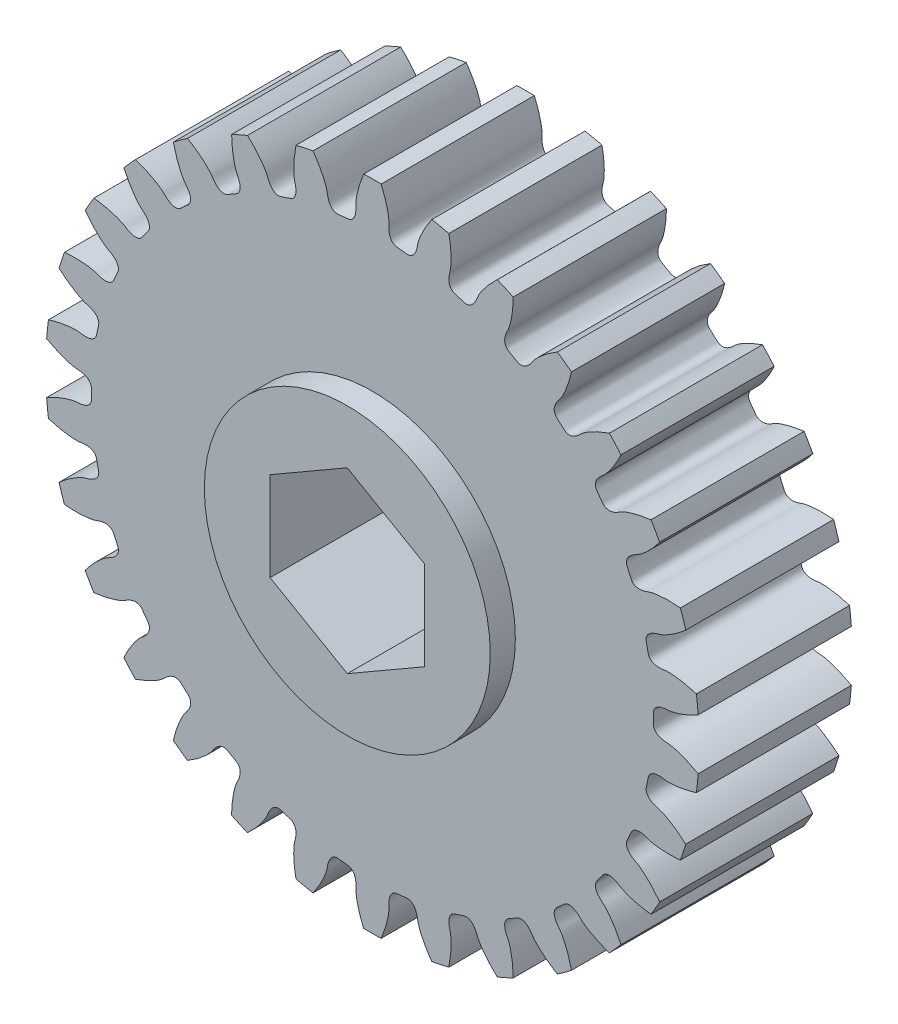
from build123d import *

# Parameters (mm, degrees)
BOSS_EXTRUDE1_DEPTH = 9.525
SKETCH2_R           = 8.89
BOSS_EXTRUDE2_DEPTH = 1.5621
BOSS_EXTRUDE3_START = 1.5621
SKETCH3_R           = 8.89
BOSS_EXTRUDE3_DEPTH = 1.5621
CUT_EXTRUDE1_DEPTH  = 32.357504029


with BuildPart() as part:
    # Sketch1 → Boss-Extrude1 (new body)
    with BuildSketch(Plane.XY.offset(4.7625)):
        with BuildLine():
            ThreePointArc((20.258045074, 1.585562928), (20.208684914, 2.124018374), (20.145015253, 2.66096983))
            add(Edge.make_bspline(
                [(19.485701115, 5.762798978), (19.348608261, 5.642423437), (19.165810451, 5.491857424), (18.935123769, 5.320049479), (18.810450403, 5.231600372), (18.691940584, 5.151573141), (18.579912745, 5.079632844), (18.474673043, 5.015434027), (18.37651506, 4.958621612), (18.285719533, 4.908831132), (18.202554043, 4.865689319), (18.127272877, 4.828814019), (18.060116392, 4.797816178), (18.001311973, 4.772295453), (17.95107022, 4.75185514), (17.9095951, 4.736060729), (17.877055221, 4.724555691), (17.829122133, 4.70860374), (17.776230485, 4.696697952), (17.717932348, 4.679918107), (17.675549853, 4.667098605), (17.634483818, 4.653717487), (17.594687889, 4.639851505), (17.55614131, 4.625474067), (17.51881179, 4.610577692), (17.482664521, 4.595140619), (17.447659244, 4.579133184), (17.413750427, 4.562513306), (17.380886724, 4.545223977), (17.349010841, 4.527189201), (17.318059756, 4.508308987), (17.287965678, 4.488452893), (17.258658302, 4.467451832), (17.230069256, 4.445087833), (17.202140202, 4.421081644), (17.174836845, 4.395078559), (17.148172171, 4.366634057), (17.122243426, 4.335203293), (17.097287767, 4.300142931), (17.073759769, 4.260741195), (17.052423821, 4.216300055), (17.034439896, 4.166300955), (17.021361823, 4.110656766), (17.015044254, 4.05005121), (17.016933283, 3.989508099), (17.041067734, 3.849516394), (17.098421884, 3.634381766), (17.133529397, 3.414518469), (17.168421235, 3.276813317), (17.191320623, 3.220736095), (17.22174251, 3.167939752), (17.256322455, 3.122425588), (17.293088054, 3.084063858), (17.330655253, 3.052142968), (17.368175278, 3.02571739), (17.405233741, 3.003838537), (17.441704872, 2.985671276), (17.477633685, 2.97053143), (17.51315295, 2.957881705), (17.548431607, 2.94731073), (17.583645258, 2.938508413), (17.61896078, 2.931243373), (17.654529288, 2.925344293), (17.690483786, 2.9206853), (17.726939259, 2.917174801), (17.763993949, 2.914747086), (17.801731108, 2.91335603), (17.84022083, 2.91297044), (17.879521827, 2.913570391), (17.919682942, 2.915145158), (17.960744825, 2.917689022), (18.002740018, 2.921208279), (18.045698299, 2.925687081), (18.089630796, 2.931214396), (18.149713772, 2.939597234), (18.202875217, 2.950233727), (18.253152515, 2.955157037), (18.287558694, 2.957881823), (18.331872267, 2.960322363), (18.386084217, 2.962084369), (18.450184941, 2.962687939), (18.5241434, 2.961685005), (18.607914703, 2.958617351), (18.701437515, 2.953031796), (18.804634969, 2.944475797), (18.91741444, 2.932499522), (19.039667703, 2.916655828), (19.171270981, 2.896500923), (19.312085096, 2.871594696), (19.461955375, 2.841501642), (19.742578732, 2.778376001), (19.970813556, 2.715177671), (20.145015253, 2.66096983)],
                knots=[0, 0, 0, 0, 0.077684917, 0.100781489, 0.122478269, 0.142775256, 0.161672451, 0.179169854, 0.195267465, 0.209965283, 0.223263309, 0.235161544, 0.245659985, 0.254758635, 0.262457493, 0.268756558, 0.273655832, 0.277155314, 0.290262703, 0.296705766, 0.302989147, 0.309117771, 0.315097288, 0.3209342, 0.326636023, 0.332211487, 0.337670777, 0.34302583, 0.348290706, 0.353482037, 0.358619588, 0.363726936, 0.368832295, 0.373969492, 0.379179082, 0.384509528, 0.390018285, 0.395772416, 0.401848037, 0.40832741, 0.415291917, 0.422808885, 0.430911277, 0.439572885, 0.448688114, 0.456601991, 0.5, 0.543398009, 0.551311886, 0.560427115, 0.569088723, 0.577191115, 0.584708083, 0.59167259, 0.598151963, 0.604227584, 0.609981715, 0.615490472, 0.620820918, 0.626030508, 0.631167705, 0.636273064, 0.641380412, 0.646517963, 0.651709294, 0.65697417, 0.662329223, 0.667788513, 0.673363977, 0.6790658, 0.684902712, 0.690882229, 0.697010853, 0.703294234, 0.709737297, 0.722844686, 0.726344168, 0.731243442, 0.737542507, 0.745241365, 0.754340015, 0.764838456, 0.776736691, 0.790034717, 0.804732535, 0.820830146, 0.838327549, 0.857224744, 0.877521731, 0.899218511, 0.922315083, 1, 1, 1, 1], degree=3))
            ThreePointArc((19.485701115, 5.762798978), (19.325468411, 6.279225326), (19.1515516, 6.791205438))
            add(Edge.make_bspline(
                [(17.861738515, 9.688173059), (17.752668951, 9.541924806), (17.605170146, 9.356643219), (17.415245402, 9.140627233), (17.311686052, 9.0281899), (17.212404553, 8.925271879), (17.11778202, 8.831611753), (17.028189743, 8.74693527), (16.943988712, 8.67095615), (16.865529308, 8.60337626), (16.793150871, 8.543886122), (16.727181585, 8.492164801), (16.667937444, 8.447881719), (16.6157241, 8.410692556), (16.57083003, 8.380253065), (16.533545083, 8.356180638), (16.504108311, 8.338161592), (16.460539273, 8.312592379), (16.411278786, 8.289949969), (16.35774333, 8.261415941), (16.318952318, 8.240064759), (16.281565765, 8.218437941), (16.245522373, 8.196600926), (16.210807366, 8.174523385), (16.177390717, 8.152191288), (16.1452429, 8.129576112), (16.114330705, 8.106640472), (16.084618344, 8.083333738), (16.056067445, 8.059589475), (16.028637768, 8.035321433), (16.002288455, 8.010418705), (15.976980319, 7.984739604), (15.952679746, 7.95810412), (15.929365176, 7.930284831), (15.907037606, 7.900996458), (15.885737239, 7.869884915), (15.865569197, 7.836518096), (15.84674188, 7.800383281), (15.82962102, 7.760900499), (15.814799248, 7.71746804), (15.803169374, 7.669562052), (15.795973838, 7.616916484), (15.79475063, 7.559769169), (15.801171718, 7.499174494), (15.815607088, 7.440347146), (15.868320056, 7.308432431), (15.969149884, 7.109923608), (16.049202364, 6.902164115), (16.111962243, 6.774722572), (16.146020334, 6.724631822), (16.186754407, 6.679314272), (16.230041623, 6.641984276), (16.273979658, 6.61210484), (16.31736265, 6.588692158), (16.359556959, 6.570644894), (16.400354475, 6.556949034), (16.43980581, 6.546761546), (16.478097243, 6.539422562), (16.515470352, 6.534434135), (16.552175916, 6.531429006), (16.588450169, 6.530140371), (16.624504448, 6.530376598), (16.660522187, 6.532001536), (16.696659652, 6.534919714), (16.733048359, 6.539065447), (16.769798066, 6.544394887), (16.806999794, 6.550880225), (16.844728592, 6.558505524), (16.883046031, 6.567263501), (16.922002117, 6.577153822), (16.961637801, 6.588179341), (17.001983602, 6.600352986), (17.043071947, 6.613665444), (17.08489522, 6.628206054), (17.141922348, 6.64889766), (17.191710637, 6.670354606), (17.239865642, 6.685623568), (17.272953449, 6.695442258), (17.315791247, 6.707042775), (17.368452194, 6.720037576), (17.431026675, 6.733955246), (17.503577486, 6.748351057), (17.586155986, 6.762767472), (17.678796402, 6.77674846), (17.781517636, 6.789835388), (17.894322612, 6.801568994), (18.017198438, 6.811489405), (18.150116308, 6.819136793), (18.293031593, 6.824051727), (18.445883545, 6.825776062), (18.733499167, 6.822374745), (18.969886184, 6.808010138), (19.1515516, 6.791205438)],
                knots=[0, 0, 0, 0, 0.077684917, 0.100781489, 0.122478269, 0.142775256, 0.161672451, 0.179169854, 0.195267465, 0.209965283, 0.223263309, 0.235161544, 0.245659985, 0.254758635, 0.262457493, 0.268756558, 0.273655832, 0.277155314, 0.290262703, 0.296705766, 0.302989147, 0.309117771, 0.315097288, 0.3209342, 0.326636023, 0.332211487, 0.337670777, 0.34302583, 0.348290706, 0.353482037, 0.358619588, 0.363726936, 0.368832295, 0.373969492, 0.379179082, 0.384509528, 0.390018285, 0.395772416, 0.401848037, 0.40832741, 0.415291917, 0.422808885, 0.430911277, 0.439572885, 0.448688114, 0.456601991, 0.5, 0.543398009, 0.551311886, 0.560427115, 0.569088723, 0.577191115, 0.584708083, 0.59167259, 0.598151963, 0.604227584, 0.609981715, 0.615490472, 0.620820918, 0.626030508, 0.631167705, 0.636273064, 0.641380412, 0.646517963, 0.651709294, 0.65697417, 0.662329223, 0.667788513, 0.673363977, 0.6790658, 0.684902712, 0.690882229, 0.697010853, 0.703294234, 0.709737297, 0.722844686, 0.726344168, 0.731243442, 0.737542507, 0.745241365, 0.754340015, 0.764838456, 0.776736691, 0.790034717, 0.804732535, 0.820830146, 0.838327549, 0.857224744, 0.877521731, 0.899218511, 0.922315083, 1, 1, 1, 1], degree=3))
            ThreePointArc((17.861738515, 9.688173059), (17.597636205, 10.16), (17.321073243, 10.62463278))
            add(Edge.make_bspline(
                [(15.457132232, 13.190127489), (15.380852821, 13.024398274), (15.275099427, 12.812498808), (15.134237243, 12.561715714), (15.056317949, 12.430204208), (14.980603849, 12.308893408), (14.907522081, 12.19760685), (14.83749284, 12.096153469), (14.770928751, 12.004328297), (14.708234523, 11.921912562), (14.649806423, 11.848674103), (14.596032192, 11.784367231), (14.547289648, 11.728734291), (14.503949352, 11.681502036), (14.466365051, 11.642393719), (14.434899809, 11.611095356), (14.409852671, 11.58734982), (14.37255186, 11.553280844), (14.329075455, 11.520891394), (14.282642434, 11.481850255), (14.24913826, 11.452900543), (14.217065161, 11.423973221), (14.186349575, 11.395119554), (14.156983353, 11.366306805), (14.128940041, 11.337515006), (14.102196691, 11.308710118), (14.076728589, 11.279848671), (14.052511257, 11.250873698), (14.029520974, 11.221712238), (14.00773631, 11.19227156), (13.987140361, 11.162434686), (13.967724255, 11.132054878), (13.949492536, 11.10094907), (13.9324714, 11.068890328), (13.916721136, 11.035599813), (13.902354687, 11.000739537), (13.889564716, 10.963908692), (13.878661672, 10.924649089), (13.870123877, 10.882469474), (13.864656111, 10.836904498), (13.863240593, 10.787627385), (13.867147926, 10.734636212), (13.877833043, 10.678483385), (13.896712156, 10.620547868), (13.923062972, 10.566007321), (14.002050646, 10.4479349), (14.141949406, 10.274727672), (14.263448175, 10.088152068), (14.351333186, 9.976543942), (14.395061479, 9.93462887), (14.444327463, 9.898770707), (14.494430092, 9.871256379), (14.54362026, 9.851165112), (14.590922999, 9.837283884), (14.635947499, 9.828403686), (14.67870102, 9.823489395), (14.719408347, 9.821726921), (14.758388881, 9.822509549), (14.795982451, 9.825400437), (14.832510711, 9.830092493), (14.868260207, 9.836373859), (14.903477499, 9.84410103), (14.938370321, 9.853178968), (14.973111372, 9.863546778), (15.007842952, 9.875167555), (15.042681537, 9.888021227), (15.07772194, 9.90209952), (15.113040884, 9.917402446), (15.14870011, 9.933935684), (15.184748598, 9.951709303), (15.221225813, 9.97073461), (15.258158919, 9.991030595), (15.295581569, 10.012594891), (15.333467741, 10.035513302), (15.384946663, 10.067609353), (15.429185808, 10.09894898), (15.473113915, 10.123896268), (15.503437253, 10.140379737), (15.542927059, 10.160633235), (15.591735467, 10.184292894), (15.650048899, 10.210916396), (15.718021243, 10.240081786), (15.795797864, 10.271352203), (15.883507054, 10.304288699), (15.981262657, 10.338446591), (16.08916302, 10.373377263), (16.207291145, 10.40862821), (16.33571446, 10.443743663), (16.47448483, 10.478264953), (16.623638091, 10.511731315), (16.905675795, 10.568202975), (17.139883759, 10.603299893), (17.321073243, 10.62463278)],
                knots=[0, 0, 0, 0, 0.077684917, 0.100781489, 0.122478269, 0.142775256, 0.161672451, 0.179169854, 0.195267465, 0.209965283, 0.223263309, 0.235161544, 0.245659985, 0.254758635, 0.262457493, 0.268756558, 0.273655832, 0.277155314, 0.290262703, 0.296705766, 0.302989147, 0.309117771, 0.315097288, 0.3209342, 0.326636023, 0.332211487, 0.337670777, 0.34302583, 0.348290706, 0.353482037, 0.358619588, 0.363726936, 0.368832295, 0.373969492, 0.379179082, 0.384509528, 0.390018285, 0.395772416, 0.401848037, 0.40832741, 0.415291917, 0.422808885, 0.430911277, 0.439572885, 0.448688114, 0.456601991, 0.5, 0.543398009, 0.551311886, 0.560427115, 0.569088723, 0.577191115, 0.584708083, 0.59167259, 0.598151963, 0.604227584, 0.609981715, 0.615490472, 0.620820918, 0.626030508, 0.631167705, 0.636273064, 0.641380412, 0.646517963, 0.651709294, 0.65697417, 0.662329223, 0.667788513, 0.673363977, 0.6790658, 0.684902712, 0.690882229, 0.697010853, 0.703294234, 0.709737297, 0.722844686, 0.726344168, 0.731243442, 0.737542507, 0.745241365, 0.754340015, 0.764838456, 0.776736691, 0.790034717, 0.804732535, 0.820830146, 0.838327549, 0.857224744, 0.877521731, 0.899218511, 0.922315083, 1, 1, 1, 1], degree=3))
            ThreePointArc((15.457132232, 13.190127489), (15.100702854, 13.596733921), (14.733580869, 13.993712687))
            add(Edge.make_bspline(
                [(12.376975098, 16.115610054), (12.336819617, 15.937643039), (12.277433564, 15.708386718), (12.191790295, 15.433796941), (12.142916504, 15.288958945), (12.094078872, 15.154557231), (12.045731892, 15.030507997), (11.998326302, 14.916711718), (11.952308325, 14.813053694), (11.908119311, 14.719404077), (11.866195137, 14.635618169), (11.826966152, 14.561536265), (11.790855489, 14.496984894), (11.75828242, 14.441773823), (11.729650503, 14.395705901), (11.705380147, 14.358549491), (11.685817324, 14.330115259), (11.656414963, 14.289035496), (11.620622767, 14.248314581), (11.583321529, 14.200472616), (11.556568485, 14.165189615), (11.531210588, 14.130226053), (11.507165226, 14.095616779), (11.484431234, 14.061328077), (11.462986888, 14.027334915), (11.442816816, 13.993599228), (11.423905887, 13.960073356), (11.406241997, 13.92669649), (11.389817115, 13.893392329), (11.374629559, 13.860065714), (11.360687116, 13.826598709), (11.348011615, 13.792845937), (11.336645564, 13.758629278), (11.326661769, 13.723732203), (11.318177173, 13.687894502), (11.311372524, 13.650809054), (11.306519608, 13.612123866), (11.304017353, 13.57145531), (11.304435763, 13.528422313), (11.308560973, 13.482716229), (11.317421675, 13.434221636), (11.332261108, 13.383200828), (11.354387558, 13.330496635), (11.384899589, 13.277752337), (11.422014194, 13.229882274), (11.523824434, 13.13081248), (11.696677878, 12.990476833), (11.854312857, 12.833239368), (11.963482004, 12.742342468), (12.014969362, 12.710434965), (12.070614097, 12.685603363), (12.125342415, 12.669107212), (12.177634868, 12.659682197), (12.226789999, 12.655939101), (12.272676902, 12.656614076), (12.315517895, 12.660696131), (12.355702108, 12.667435701), (12.393668106, 12.676305734), (12.429839117, 12.686949592), (12.464593613, 12.699133768), (12.498255928, 12.712710609), (12.531097068, 12.72759101), (12.563339989, 12.743725199), (12.595166276, 12.761089518), (12.626722792, 12.779677454), (12.658127641, 12.799493592), (12.689475287, 12.82054955), (12.72084077, 12.842861291), (12.752283303, 12.866447208), (12.783848702, 12.891327333), (12.815573218, 12.917520932), (12.847479474, 12.945052225), (12.87960088, 12.973925896), (12.911894143, 13.004220462), (12.955574982, 13.046318207), (12.992331522, 13.086170824), (13.030112861, 13.119706121), (13.056346455, 13.142133963), (13.090762376, 13.170155266), (13.133585083, 13.203445744), (13.185088889, 13.241611502), (13.245512049, 13.284271803), (13.315087579, 13.331029555), (13.39403223, 13.381482076), (13.482549814, 13.435218069), (13.5808298, 13.491819168), (13.689047457, 13.550860016), (13.807363501, 13.611908821), (13.935924026, 13.67452772), (14.074859883, 13.738273468), (14.338993268, 13.852150023), (14.560786166, 13.935174563), (14.733580869, 13.993712687)],
                knots=[0, 0, 0, 0, 0.077684917, 0.100781489, 0.122478269, 0.142775256, 0.161672451, 0.179169854, 0.195267465, 0.209965283, 0.223263309, 0.235161544, 0.245659985, 0.254758635, 0.262457493, 0.268756558, 0.273655832, 0.277155314, 0.290262703, 0.296705766, 0.302989147, 0.309117771, 0.315097288, 0.3209342, 0.326636023, 0.332211487, 0.337670777, 0.34302583, 0.348290706, 0.353482037, 0.358619588, 0.363726936, 0.368832295, 0.373969492, 0.379179082, 0.384509528, 0.390018285, 0.395772416, 0.401848037, 0.40832741, 0.415291917, 0.422808885, 0.430911277, 0.439572885, 0.448688114, 0.456601991, 0.5, 0.543398009, 0.551311886, 0.560427115, 0.569088723, 0.577191115, 0.584708083, 0.59167259, 0.598151963, 0.604227584, 0.609981715, 0.615490472, 0.620820918, 0.626030508, 0.631167705, 0.636273064, 0.641380412, 0.646517963, 0.651709294, 0.65697417, 0.662329223, 0.667788513, 0.673363977, 0.6790658, 0.684902712, 0.690882229, 0.697010853, 0.703294234, 0.709737297, 0.722844686, 0.726344168, 0.731243442, 0.737542507, 0.745241365, 0.754340015, 0.764838456, 0.776736691, 0.790034717, 0.804732535, 0.820830146, 0.838327549, 0.857224744, 0.877521731, 0.899218511, 0.922315083, 1, 1, 1, 1], degree=3))
            ThreePointArc((12.376975098, 16.115610054), (11.943796327, 16.439225326), (11.502160312, 16.751200201))
            add(Edge.make_bspline(
                [(8.755884762, 18.336763129), (8.753608197, 18.154336325), (8.743184942, 17.91774275), (8.716503607, 17.631347183), (8.698811339, 17.479512811), (8.678984614, 17.337894182), (8.657485418, 17.20650382), (8.634775331, 17.085338086), (8.611314672, 16.974377563), (8.587562144, 16.873587003), (8.563974184, 16.782915492), (8.54100494, 16.702296291), (8.519104366, 16.631647693), (8.498722124, 16.570870795), (8.480293943, 16.519856657), (8.464279204, 16.478466112), (8.451055685, 16.446585897), (8.430836799, 16.400290731), (8.404293103, 16.353018049), (8.37775389, 16.298466183), (8.358921212, 16.25839193), (8.34138678, 16.218920203), (8.32506254, 16.180067912), (8.309954362, 16.141801837), (8.296046202, 16.104092977), (8.283330938, 16.066900902), (8.271803679, 16.030175848), (8.261465228, 15.993855817), (8.252323593, 15.957864507), (8.244396915, 15.922108488), (8.23771733, 15.886474021), (8.232336415, 15.850823443), (8.228332783, 15.814991365), (8.225822667, 15.778781127), (8.224974557, 15.741962519), (8.226029104, 15.704272711), (8.229325339, 15.66542391), (8.235333232, 15.625123811), (8.244689562, 15.583118181), (8.258227455, 15.539268564), (8.276977122, 15.493675937), (8.302100101, 15.446855348), (8.334700853, 15.399903216), (8.375512279, 15.354655315), (8.421768586, 15.315547888), (8.541951797, 15.239810546), (8.7402054, 15.138479822), (8.927087183, 15.017452527), (9.052769251, 14.951239485), (9.10976543, 14.930734061), (9.169356974, 14.91801428), (9.226319089, 14.913257266), (9.279428398, 14.914910423), (9.328287605, 14.921469048), (9.373031433, 14.931669697), (9.414087542, 14.944569693), (9.451992397, 14.959516754), (9.487284564, 14.976086532), (9.520452169, 14.994018171), (9.551913963, 15.01316196), (9.582017892, 15.033440903), (9.611047565, 15.054824189), (9.639231414, 15.077309487), (9.666751975, 15.100911412), (9.693754256, 15.125654125), (9.720352828, 15.151566668), (9.746637672, 15.178680045), (9.772678872, 15.207025472), (9.798530522, 15.23663325), (9.824233273, 15.2675325), (9.849818577, 15.299749603), (9.875303527, 15.333312956), (9.90071983, 15.368234083), (9.926008812, 15.404580787), (9.959982508, 15.454840353), (9.987650003, 15.501464209), (10.01763335, 15.542121861), (10.038630666, 15.569513872), (10.06646856, 15.604078314), (10.101434009, 15.645544657), (10.143877226, 15.693584645), (10.19411042, 15.747875398), (10.252444074, 15.808076946), (10.319173926, 15.873840474), (10.394584847, 15.944806048), (10.478949149, 16.020603836), (10.572526709, 16.100854215), (10.675564503, 16.185168246), (10.788296471, 16.273148008), (10.91094276, 16.364387148), (11.14562793, 16.530691645), (11.345312348, 16.658015236), (11.502160312, 16.751200201)],
                knots=[0, 0, 0, 0, 0.077684917, 0.100781489, 0.122478269, 0.142775256, 0.161672451, 0.179169854, 0.195267465, 0.209965283, 0.223263309, 0.235161544, 0.245659985, 0.254758635, 0.262457493, 0.268756558, 0.273655832, 0.277155314, 0.290262703, 0.296705766, 0.302989147, 0.309117771, 0.315097288, 0.3209342, 0.326636023, 0.332211487, 0.337670777, 0.34302583, 0.348290706, 0.353482037, 0.358619588, 0.363726936, 0.368832295, 0.373969492, 0.379179082, 0.384509528, 0.390018285, 0.395772416, 0.401848037, 0.40832741, 0.415291917, 0.422808885, 0.430911277, 0.439572885, 0.448688114, 0.456601991, 0.5, 0.543398009, 0.551311886, 0.560427115, 0.569088723, 0.577191115, 0.584708083, 0.59167259, 0.598151963, 0.604227584, 0.609981715, 0.615490472, 0.620820918, 0.626030508, 0.631167705, 0.636273064, 0.641380412, 0.646517963, 0.651709294, 0.65697417, 0.662329223, 0.667788513, 0.673363977, 0.6790658, 0.684902712, 0.690882229, 0.697010853, 0.703294234, 0.709737297, 0.722844686, 0.726344168, 0.731243442, 0.737542507, 0.745241365, 0.754340015, 0.764838456, 0.776736691, 0.790034717, 0.804732535, 0.820830146, 0.838327549, 0.857224744, 0.877521731, 0.899218511, 0.922315083, 1, 1, 1, 1], degree=3))
            ThreePointArc((8.755884762, 18.336763129), (8.264888587, 18.563243699), (7.768040155, 18.776579884))
            add(Edge.make_bspline(
                [(4.752120246, 19.756511665), (4.787822095, 19.577598001), (4.826817183, 19.344007446), (4.860263886, 19.058322948), (4.874526377, 18.906128092), (4.884577082, 18.763481962), (4.890865288, 18.63049286), (4.893843243, 18.507253195), (4.893965246, 18.393839681), (4.891687303, 18.290313208), (4.887466464, 18.196718874), (4.881760828, 18.113085822), (4.875027503, 18.03942768), (4.86772689, 17.975741197), (4.860307844, 17.922010405), (4.853248644, 17.878194693), (4.84694236, 17.844261812), (4.836790611, 17.794774564), (4.820655502, 17.743016159), (4.806038205, 17.68413857), (4.795948972, 17.641024501), (4.787004343, 17.598769712), (4.779114672, 17.557372436), (4.772292608, 17.5168014), (4.766528488, 17.4770249), (4.761823751, 17.43800191), (4.758183957, 17.399682734), (4.755622786, 17.362006898), (4.754163932, 17.324901431), (4.753844565, 17.288278719), (4.754719767, 17.252034186), (4.75686861, 17.216043904), (4.760402374, 17.180162441), (4.765475642, 17.144221601), (4.772301085, 17.108031236), (4.781168739, 17.071384293), (4.792470064, 17.034069757), (4.806725531, 16.995899423), (4.824610865, 16.956757007), (4.846969771, 16.916680296), (4.874788953, 16.875982253), (4.909097481, 16.835408166), (4.950747726, 16.796260129), (5.000074892, 16.760486176), (5.053451279, 16.731850567), (5.186754878, 16.682755762), (5.401744006, 16.624858599), (5.609704963, 16.545330949), (5.746407042, 16.506695591), (5.806421034, 16.498488432), (5.867354952, 16.498436388), (5.924061347, 16.505626416), (5.975666379, 16.518285494), (6.02209428, 16.534859197), (6.063739515, 16.554139703), (6.101216389, 16.575293847), (6.135185263, 16.597795142), (6.166261161, 16.621340484), (6.194975777, 16.645776208), (6.221769838, 16.671042933), (6.246999694, 16.697137691), (6.270949164, 16.72408931), (6.293842172, 16.751943002), (6.315854227, 16.780751014), (6.337122144, 16.81056713), (6.357751952, 16.841443576), (6.377825222, 16.873429386), (6.397404014, 16.906569668), (6.41653494, 16.940905305), (6.435251708, 16.976473235), (6.453579599, 17.013305801), (6.471529429, 17.051434333), (6.489129814, 17.090876696), (6.506309267, 17.131687013), (6.529091004, 17.187911815), (6.546460254, 17.239269223), (6.567335191, 17.285272296), (6.582178547, 17.316431314), (6.602221764, 17.356028263), (6.627801796, 17.403858193), (6.659329452, 17.459672833), (6.697177248, 17.523221271), (6.741719566, 17.59423552), (6.793318204, 17.672435873), (6.852326644, 17.757529491), (6.919088137, 17.84921124), (6.993935811, 17.947163824), (7.077192109, 18.051058154), (7.169168592, 18.160553641), (7.270165081, 18.275298583), (7.465145168, 18.486762719), (7.633993939, 18.65282071), (7.768040155, 18.776579884)],
                knots=[0, 0, 0, 0, 0.077684917, 0.100781489, 0.122478269, 0.142775256, 0.161672451, 0.179169854, 0.195267465, 0.209965283, 0.223263309, 0.235161544, 0.245659985, 0.254758635, 0.262457493, 0.268756558, 0.273655832, 0.277155314, 0.290262703, 0.296705766, 0.302989147, 0.309117771, 0.315097288, 0.3209342, 0.326636023, 0.332211487, 0.337670777, 0.34302583, 0.348290706, 0.353482037, 0.358619588, 0.363726936, 0.368832295, 0.373969492, 0.379179082, 0.384509528, 0.390018285, 0.395772416, 0.401848037, 0.40832741, 0.415291917, 0.422808885, 0.430911277, 0.439572885, 0.448688114, 0.456601991, 0.5, 0.543398009, 0.551311886, 0.560427115, 0.569088723, 0.577191115, 0.584708083, 0.59167259, 0.598151963, 0.604227584, 0.609981715, 0.615490472, 0.620820918, 0.626030508, 0.631167705, 0.636273064, 0.641380412, 0.646517963, 0.651709294, 0.65697417, 0.662329223, 0.667788513, 0.673363977, 0.6790658, 0.684902712, 0.690882229, 0.697010853, 0.703294234, 0.709737297, 0.722844686, 0.726344168, 0.731243442, 0.737542507, 0.745241365, 0.754340015, 0.764838456, 0.776736691, 0.790034717, 0.804732535, 0.820830146, 0.838327549, 0.857224744, 0.877521731, 0.899218511, 0.922315083, 1, 1, 1, 1], degree=3))
            ThreePointArc((4.752120246, 19.756511665), (4.224765557, 19.875959247), (3.694419369, 19.981332927))
            add(Edge.make_bspline(
                [(0.540665272, 20.312805839), (0.612785192, 20.1452247), (0.699494351, 19.924846194), (0.791607311, 19.652358548), (0.837201222, 19.506454853), (0.876690093, 19.369015543), (0.910490876, 19.240239963), (0.939026722, 19.120312533), (0.962726055, 19.009402741), (0.982022254, 18.907664959), (0.997353007, 18.815238325), (1.009160342, 18.732246587), (1.017888546, 18.658798115), (1.023988633, 18.594985451), (1.02790297, 18.5408863), (1.03010783, 18.496560376), (1.030994396, 18.46205786), (1.031353464, 18.41154136), (1.026332124, 18.357559322), (1.024275589, 18.296929242), (1.023370749, 18.25265965), (1.023406846, 18.209468537), (1.02429656, 18.167335536), (1.026058768, 18.126232688), (1.028690607, 18.086126972), (1.032202015, 18.046978557), (1.036608765, 18.008739991), (1.041936808, 17.971354965), (1.048224494, 17.93475703), (1.055526396, 17.898868211), (1.063918134, 17.863597673), (1.07350282, 17.828840634), (1.084419539, 17.794477978), (1.096854465, 17.760377324), (1.111055155, 17.726396895), (1.127348358, 17.692394464), (1.14616085, 17.658245018), (1.16804086, 17.623872676), (1.193673522, 17.589304185), (1.223876249, 17.554751924), (1.259549114, 17.520727164), (1.301543746, 17.488172863), (1.350423168, 17.458539877), (1.40611024, 17.433803365), (1.464273902, 17.416891088), (1.604871881, 17.396584499), (1.827200478, 17.384651281), (2.047151718, 17.350099015), (2.18889927, 17.340729893), (2.249308178, 17.34517969), (2.308921364, 17.357797657), (2.362893697, 17.376620488), (2.410739065, 17.399732224), (2.452706538, 17.425596656), (2.489433082, 17.453114368), (2.521692802, 17.481598123), (2.550241094, 17.510670238), (2.575742556, 17.5401621), (2.598749216, 17.570033948), (2.619704516, 17.600319334), (2.638957633, 17.631089441), (2.656780194, 17.662431477), (2.673381826, 17.694436223), (2.688923342, 17.727191274), (2.703527385, 17.760777685), (2.717286809, 17.795268585), (2.730271205, 17.830728896), (2.742531901, 17.867215643), (2.75410599, 17.904778507), (2.765018764, 17.943460627), (2.775288226, 17.983298896), (2.784918441, 18.024326207), (2.793933687, 18.066565986), (2.802252786, 18.110056309), (2.812846894, 18.169789053), (2.819158778, 18.223635449), (2.830012971, 18.272973388), (2.83805364, 18.306537614), (2.849426196, 18.349436494), (2.864502842, 18.401539612), (2.883737026, 18.462689537), (2.907545294, 18.532718288), (2.936349563, 18.611441574), (2.970561879, 18.698661022), (3.010588885, 18.794163685), (3.056829772, 18.897722463), (3.109676357, 19.009096254), (3.16951246, 19.128030201), (3.236713644, 19.254255935), (3.311646302, 19.387491777), (3.45839974, 19.634873553), (3.589033363, 19.832408412), (3.694419369, 19.981332927)],
                knots=[0, 0, 0, 0, 0.077684917, 0.100781489, 0.122478269, 0.142775256, 0.161672451, 0.179169854, 0.195267465, 0.209965283, 0.223263309, 0.235161544, 0.245659985, 0.254758635, 0.262457493, 0.268756558, 0.273655832, 0.277155314, 0.290262703, 0.296705766, 0.302989147, 0.309117771, 0.315097288, 0.3209342, 0.326636023, 0.332211487, 0.337670777, 0.34302583, 0.348290706, 0.353482037, 0.358619588, 0.363726936, 0.368832295, 0.373969492, 0.379179082, 0.384509528, 0.390018285, 0.395772416, 0.401848037, 0.40832741, 0.415291917, 0.422808885, 0.430911277, 0.439572885, 0.448688114, 0.456601991, 0.5, 0.543398009, 0.551311886, 0.560427115, 0.569088723, 0.577191115, 0.584708083, 0.59167259, 0.598151963, 0.604227584, 0.609981715, 0.615490472, 0.620820918, 0.626030508, 0.631167705, 0.636273064, 0.641380412, 0.646517963, 0.651709294, 0.65697417, 0.662329223, 0.667788513, 0.673363977, 0.6790658, 0.684902712, 0.690882229, 0.697010853, 0.703294234, 0.709737297, 0.722844686, 0.726344168, 0.731243442, 0.737542507, 0.745241365, 0.754340015, 0.764838456, 0.776736691, 0.790034717, 0.804732535, 0.820830146, 0.838327549, 0.857224744, 0.877521731, 0.899218511, 0.922315083, 1, 1, 1, 1], degree=3))
            ThreePointArc((0.540665272, 20.312805839), (0, 20.32), (-0.540665272, 20.312805839))
            add(Edge.make_bspline(
                [(-3.694419369, 19.981332927), (-3.589033363, 19.832408412), (-3.45839974, 19.634873553), (-3.311646302, 19.387491777), (-3.236713644, 19.254255935), (-3.16951246, 19.128030201), (-3.109676357, 19.009096254), (-3.056829772, 18.897722463), (-3.010588885, 18.794163685), (-2.970561879, 18.698661022), (-2.936349563, 18.611441574), (-2.907545294, 18.532718288), (-2.883737026, 18.462689537), (-2.864502842, 18.401539612), (-2.849426196, 18.349436494), (-2.83805364, 18.306537614), (-2.830012971, 18.272973388), (-2.819158778, 18.223635449), (-2.812846894, 18.169789053), (-2.802252786, 18.110056309), (-2.793933687, 18.066565986), (-2.784918441, 18.024326207), (-2.775288226, 17.983298896), (-2.765018764, 17.943460627), (-2.75410599, 17.904778507), (-2.742531901, 17.867215643), (-2.730271205, 17.830728896), (-2.717286809, 17.795268585), (-2.703527385, 17.760777685), (-2.688923342, 17.727191274), (-2.673381826, 17.694436223), (-2.656780194, 17.662431477), (-2.638957633, 17.631089441), (-2.619704516, 17.600319334), (-2.598749216, 17.570033948), (-2.575742556, 17.5401621), (-2.550241094, 17.510670238), (-2.521692802, 17.481598123), (-2.489433082, 17.453114368), (-2.452706538, 17.425596656), (-2.410739065, 17.399732224), (-2.362893697, 17.376620488), (-2.308921364, 17.357797657), (-2.249308178, 17.34517969), (-2.18889927, 17.340729893), (-2.047151718, 17.350099015), (-1.827200478, 17.384651281), (-1.604871881, 17.396584499), (-1.464273902, 17.416891088), (-1.40611024, 17.433803365), (-1.350423168, 17.458539877), (-1.301543746, 17.488172863), (-1.259549114, 17.520727164), (-1.223876249, 17.554751924), (-1.193673522, 17.589304185), (-1.16804086, 17.623872676), (-1.14616085, 17.658245018), (-1.127348358, 17.692394464), (-1.111055155, 17.726396895), (-1.096854465, 17.760377324), (-1.084419539, 17.794477978), (-1.07350282, 17.828840634), (-1.063918134, 17.863597673), (-1.055526396, 17.898868211), (-1.048224494, 17.93475703), (-1.041936808, 17.971354965), (-1.036608765, 18.008739991), (-1.032202015, 18.046978557), (-1.028690607, 18.086126972), (-1.026058768, 18.126232688), (-1.02429656, 18.167335536), (-1.023406846, 18.209468537), (-1.023370749, 18.25265965), (-1.024275589, 18.296929242), (-1.026332124, 18.357559322), (-1.031353464, 18.41154136), (-1.030994396, 18.46205786), (-1.03010783, 18.496560376), (-1.02790297, 18.5408863), (-1.023988633, 18.594985451), (-1.017888546, 18.658798115), (-1.009160342, 18.732246587), (-0.997353007, 18.815238325), (-0.982022254, 18.907664959), (-0.962726055, 19.009402741), (-0.939026722, 19.120312533), (-0.910490876, 19.240239963), (-0.876690093, 19.369015543), (-0.837201222, 19.506454853), (-0.791607311, 19.652358548), (-0.699494351, 19.924846194), (-0.612785192, 20.1452247), (-0.540665272, 20.312805839)],
                knots=[0, 0, 0, 0, 0.077684917, 0.100781489, 0.122478269, 0.142775256, 0.161672451, 0.179169854, 0.195267465, 0.209965283, 0.223263309, 0.235161544, 0.245659985, 0.254758635, 0.262457493, 0.268756558, 0.273655832, 0.277155314, 0.290262703, 0.296705766, 0.302989147, 0.309117771, 0.315097288, 0.3209342, 0.326636023, 0.332211487, 0.337670777, 0.34302583, 0.348290706, 0.353482037, 0.358619588, 0.363726936, 0.368832295, 0.373969492, 0.379179082, 0.384509528, 0.390018285, 0.395772416, 0.401848037, 0.40832741, 0.415291917, 0.422808885, 0.430911277, 0.439572885, 0.448688114, 0.456601991, 0.5, 0.543398009, 0.551311886, 0.560427115, 0.569088723, 0.577191115, 0.584708083, 0.59167259, 0.598151963, 0.604227584, 0.609981715, 0.615490472, 0.620820918, 0.626030508, 0.631167705, 0.636273064, 0.641380412, 0.646517963, 0.651709294, 0.65697417, 0.662329223, 0.667788513, 0.673363977, 0.6790658, 0.684902712, 0.690882229, 0.697010853, 0.703294234, 0.709737297, 0.722844686, 0.726344168, 0.731243442, 0.737542507, 0.745241365, 0.754340015, 0.764838456, 0.776736691, 0.790034717, 0.804732535, 0.820830146, 0.838327549, 0.857224744, 0.877521731, 0.899218511, 0.922315083, 1, 1, 1, 1], degree=3))
            ThreePointArc((-3.694419369, 19.981332927), (-4.224765557, 19.875959247), (-4.752120246, 19.756511665))
            add(Edge.make_bspline(
                [(-7.768040155, 18.776579884), (-7.633993939, 18.65282071), (-7.465145168, 18.486762719), (-7.270165081, 18.275298583), (-7.169168592, 18.160553641), (-7.077192109, 18.051058154), (-6.993935811, 17.947163824), (-6.919088137, 17.84921124), (-6.852326644, 17.757529491), (-6.793318204, 17.672435873), (-6.741719566, 17.59423552), (-6.697177248, 17.523221271), (-6.659329452, 17.459672833), (-6.627801796, 17.403858193), (-6.602221764, 17.356028263), (-6.582178547, 17.316431314), (-6.567335191, 17.285272296), (-6.546460254, 17.239269223), (-6.529091004, 17.187911815), (-6.506309267, 17.131687013), (-6.489129814, 17.090876696), (-6.471529429, 17.051434333), (-6.453579599, 17.013305801), (-6.435251708, 16.976473235), (-6.41653494, 16.940905305), (-6.397404014, 16.906569668), (-6.377825222, 16.873429386), (-6.357751952, 16.841443576), (-6.337122144, 16.81056713), (-6.315854227, 16.780751014), (-6.293842172, 16.751943002), (-6.270949164, 16.72408931), (-6.246999694, 16.697137691), (-6.221769838, 16.671042933), (-6.194975777, 16.645776208), (-6.166261161, 16.621340484), (-6.135185263, 16.597795142), (-6.101216389, 16.575293847), (-6.063739515, 16.554139703), (-6.02209428, 16.534859197), (-5.975666379, 16.518285494), (-5.924061347, 16.505626416), (-5.867354952, 16.498436388), (-5.806421034, 16.498488432), (-5.746407042, 16.506695591), (-5.609704963, 16.545330949), (-5.401744006, 16.624858599), (-5.186754878, 16.682755762), (-5.053451279, 16.731850567), (-5.000074892, 16.760486176), (-4.950747726, 16.796260129), (-4.909097481, 16.835408166), (-4.874788953, 16.875982253), (-4.846969771, 16.916680296), (-4.824610865, 16.956757007), (-4.806725531, 16.995899423), (-4.792470064, 17.034069757), (-4.781168739, 17.071384293), (-4.772301085, 17.108031236), (-4.765475642, 17.144221601), (-4.760402374, 17.180162441), (-4.75686861, 17.216043904), (-4.754719767, 17.252034186), (-4.753844565, 17.288278719), (-4.754163932, 17.324901431), (-4.755622786, 17.362006898), (-4.758183957, 17.399682734), (-4.761823751, 17.43800191), (-4.766528488, 17.4770249), (-4.772292608, 17.5168014), (-4.779114672, 17.557372436), (-4.787004343, 17.598769712), (-4.795948972, 17.641024501), (-4.806038205, 17.68413857), (-4.820655502, 17.743016159), (-4.836790611, 17.794774564), (-4.84694236, 17.844261812), (-4.853248644, 17.878194693), (-4.860307844, 17.922010405), (-4.86772689, 17.975741197), (-4.875027503, 18.03942768), (-4.881760828, 18.113085822), (-4.887466464, 18.196718874), (-4.891687303, 18.290313208), (-4.893965246, 18.393839681), (-4.893843243, 18.507253195), (-4.890865288, 18.63049286), (-4.884577082, 18.763481962), (-4.874526377, 18.906128092), (-4.860263886, 19.058322948), (-4.826817183, 19.344007446), (-4.787822095, 19.577598001), (-4.752120246, 19.756511665)],
                knots=[0, 0, 0, 0, 0.077684917, 0.100781489, 0.122478269, 0.142775256, 0.161672451, 0.179169854, 0.195267465, 0.209965283, 0.223263309, 0.235161544, 0.245659985, 0.254758635, 0.262457493, 0.268756558, 0.273655832, 0.277155314, 0.290262703, 0.296705766, 0.302989147, 0.309117771, 0.315097288, 0.3209342, 0.326636023, 0.332211487, 0.337670777, 0.34302583, 0.348290706, 0.353482037, 0.358619588, 0.363726936, 0.368832295, 0.373969492, 0.379179082, 0.384509528, 0.390018285, 0.395772416, 0.401848037, 0.40832741, 0.415291917, 0.422808885, 0.430911277, 0.439572885, 0.448688114, 0.456601991, 0.5, 0.543398009, 0.551311886, 0.560427115, 0.569088723, 0.577191115, 0.584708083, 0.59167259, 0.598151963, 0.604227584, 0.609981715, 0.615490472, 0.620820918, 0.626030508, 0.631167705, 0.636273064, 0.641380412, 0.646517963, 0.651709294, 0.65697417, 0.662329223, 0.667788513, 0.673363977, 0.6790658, 0.684902712, 0.690882229, 0.697010853, 0.703294234, 0.709737297, 0.722844686, 0.726344168, 0.731243442, 0.737542507, 0.745241365, 0.754340015, 0.764838456, 0.776736691, 0.790034717, 0.804732535, 0.820830146, 0.838327549, 0.857224744, 0.877521731, 0.899218511, 0.922315083, 1, 1, 1, 1], degree=3))
            ThreePointArc((-7.768040155, 18.776579884), (-8.264888587, 18.563243699), (-8.755884762, 18.336763129))
            add(Edge.make_bspline(
                [(-11.502160312, 16.751200201), (-11.345312348, 16.658015236), (-11.14562793, 16.530691645), (-10.91094276, 16.364387148), (-10.788296471, 16.273148008), (-10.675564503, 16.185168246), (-10.572526709, 16.100854215), (-10.478949149, 16.020603836), (-10.394584847, 15.944806048), (-10.319173926, 15.873840474), (-10.252444074, 15.808076946), (-10.19411042, 15.747875398), (-10.143877226, 15.693584645), (-10.101434009, 15.645544657), (-10.06646856, 15.604078314), (-10.038630666, 15.569513872), (-10.01763335, 15.542121861), (-9.987650003, 15.501464209), (-9.959982508, 15.454840353), (-9.926008812, 15.404580787), (-9.90071983, 15.368234083), (-9.875303527, 15.333312956), (-9.849818577, 15.299749603), (-9.824233273, 15.2675325), (-9.798530522, 15.23663325), (-9.772678872, 15.207025472), (-9.746637672, 15.178680045), (-9.720352828, 15.151566668), (-9.693754256, 15.125654125), (-9.666751975, 15.100911412), (-9.639231414, 15.077309487), (-9.611047565, 15.054824189), (-9.582017892, 15.033440903), (-9.551913963, 15.01316196), (-9.520452169, 14.994018171), (-9.487284564, 14.976086532), (-9.451992397, 14.959516754), (-9.414087542, 14.944569693), (-9.373031433, 14.931669697), (-9.328287605, 14.921469048), (-9.279428398, 14.914910423), (-9.226319089, 14.913257266), (-9.169356974, 14.91801428), (-9.10976543, 14.930734061), (-9.052769251, 14.951239485), (-8.927087183, 15.017452527), (-8.7402054, 15.138479822), (-8.541951797, 15.239810546), (-8.421768586, 15.315547888), (-8.375512279, 15.354655315), (-8.334700853, 15.399903216), (-8.302100101, 15.446855348), (-8.276977122, 15.493675937), (-8.258227455, 15.539268564), (-8.244689562, 15.583118181), (-8.235333232, 15.625123811), (-8.229325339, 15.66542391), (-8.226029104, 15.704272711), (-8.224974557, 15.741962519), (-8.225822667, 15.778781127), (-8.228332783, 15.814991365), (-8.232336415, 15.850823443), (-8.23771733, 15.886474021), (-8.244396915, 15.922108488), (-8.252323593, 15.957864507), (-8.261465228, 15.993855817), (-8.271803679, 16.030175848), (-8.283330938, 16.066900902), (-8.296046202, 16.104092977), (-8.309954362, 16.141801837), (-8.32506254, 16.180067912), (-8.34138678, 16.218920203), (-8.358921212, 16.25839193), (-8.37775389, 16.298466183), (-8.404293103, 16.353018049), (-8.430836799, 16.400290731), (-8.451055685, 16.446585897), (-8.464279204, 16.478466112), (-8.480293943, 16.519856657), (-8.498722124, 16.570870795), (-8.519104366, 16.631647693), (-8.54100494, 16.702296291), (-8.563974184, 16.782915492), (-8.587562144, 16.873587003), (-8.611314672, 16.974377563), (-8.634775331, 17.085338086), (-8.657485418, 17.20650382), (-8.678984614, 17.337894182), (-8.698811339, 17.479512811), (-8.716503607, 17.631347183), (-8.743184942, 17.91774275), (-8.753608197, 18.154336325), (-8.755884762, 18.336763129)],
                knots=[0, 0, 0, 0, 0.077684917, 0.100781489, 0.122478269, 0.142775256, 0.161672451, 0.179169854, 0.195267465, 0.209965283, 0.223263309, 0.235161544, 0.245659985, 0.254758635, 0.262457493, 0.268756558, 0.273655832, 0.277155314, 0.290262703, 0.296705766, 0.302989147, 0.309117771, 0.315097288, 0.3209342, 0.326636023, 0.332211487, 0.337670777, 0.34302583, 0.348290706, 0.353482037, 0.358619588, 0.363726936, 0.368832295, 0.373969492, 0.379179082, 0.384509528, 0.390018285, 0.395772416, 0.401848037, 0.40832741, 0.415291917, 0.422808885, 0.430911277, 0.439572885, 0.448688114, 0.456601991, 0.5, 0.543398009, 0.551311886, 0.560427115, 0.569088723, 0.577191115, 0.584708083, 0.59167259, 0.598151963, 0.604227584, 0.609981715, 0.615490472, 0.620820918, 0.626030508, 0.631167705, 0.636273064, 0.641380412, 0.646517963, 0.651709294, 0.65697417, 0.662329223, 0.667788513, 0.673363977, 0.6790658, 0.684902712, 0.690882229, 0.697010853, 0.703294234, 0.709737297, 0.722844686, 0.726344168, 0.731243442, 0.737542507, 0.745241365, 0.754340015, 0.764838456, 0.776736691, 0.790034717, 0.804732535, 0.820830146, 0.838327549, 0.857224744, 0.877521731, 0.899218511, 0.922315083, 1, 1, 1, 1], degree=3))
            ThreePointArc((-11.502160312, 16.751200201), (-11.943796327, 16.439225326), (-12.376975098, 16.115610054))
            add(Edge.make_bspline(
                [(-14.733580869, 13.993712687), (-14.560786166, 13.935174563), (-14.338993268, 13.852150023), (-14.074859883, 13.738273468), (-13.935924026, 13.67452772), (-13.807363501, 13.611908821), (-13.689047457, 13.550860016), (-13.5808298, 13.491819168), (-13.482549814, 13.435218069), (-13.39403223, 13.381482076), (-13.315087579, 13.331029555), (-13.245512049, 13.284271803), (-13.185088889, 13.241611502), (-13.133585083, 13.203445744), (-13.090762376, 13.170155266), (-13.056346455, 13.142133963), (-13.030112861, 13.119706121), (-12.992331522, 13.086170824), (-12.955574982, 13.046318207), (-12.911894143, 13.004220462), (-12.87960088, 12.973925896), (-12.847479474, 12.945052225), (-12.815573218, 12.917520932), (-12.783848702, 12.891327333), (-12.752283303, 12.866447208), (-12.72084077, 12.842861291), (-12.689475287, 12.82054955), (-12.658127641, 12.799493592), (-12.626722792, 12.779677454), (-12.595166276, 12.761089518), (-12.563339989, 12.743725199), (-12.531097068, 12.72759101), (-12.498255928, 12.712710609), (-12.464593613, 12.699133768), (-12.429839117, 12.686949592), (-12.393668106, 12.676305734), (-12.355702108, 12.667435701), (-12.315517895, 12.660696131), (-12.272676902, 12.656614076), (-12.226789999, 12.655939101), (-12.177634868, 12.659682197), (-12.125342415, 12.669107212), (-12.070614097, 12.685603363), (-12.014969362, 12.710434965), (-11.963482004, 12.742342468), (-11.854312857, 12.833239368), (-11.696677878, 12.990476833), (-11.523824434, 13.13081248), (-11.422014194, 13.229882274), (-11.384899589, 13.277752337), (-11.354387558, 13.330496635), (-11.332261108, 13.383200828), (-11.317421675, 13.434221636), (-11.308560973, 13.482716229), (-11.304435763, 13.528422313), (-11.304017353, 13.57145531), (-11.306519608, 13.612123866), (-11.311372524, 13.650809054), (-11.318177173, 13.687894502), (-11.326661769, 13.723732203), (-11.336645564, 13.758629278), (-11.348011615, 13.792845937), (-11.360687116, 13.826598709), (-11.374629559, 13.860065714), (-11.389817115, 13.893392329), (-11.406241997, 13.92669649), (-11.423905887, 13.960073356), (-11.442816816, 13.993599228), (-11.462986888, 14.027334915), (-11.484431234, 14.061328077), (-11.507165226, 14.095616779), (-11.531210588, 14.130226053), (-11.556568485, 14.165189615), (-11.583321529, 14.200472616), (-11.620622767, 14.248314581), (-11.656414963, 14.289035496), (-11.685817324, 14.330115259), (-11.705380147, 14.358549491), (-11.729650503, 14.395705901), (-11.75828242, 14.441773823), (-11.790855489, 14.496984894), (-11.826966152, 14.561536265), (-11.866195137, 14.635618169), (-11.908119311, 14.719404077), (-11.952308325, 14.813053694), (-11.998326302, 14.916711718), (-12.045731892, 15.030507997), (-12.094078872, 15.154557231), (-12.142916504, 15.288958945), (-12.191790295, 15.433796941), (-12.277433564, 15.708386718), (-12.336819617, 15.937643039), (-12.376975098, 16.115610054)],
                knots=[0, 0, 0, 0, 0.077684917, 0.100781489, 0.122478269, 0.142775256, 0.161672451, 0.179169854, 0.195267465, 0.209965283, 0.223263309, 0.235161544, 0.245659985, 0.254758635, 0.262457493, 0.268756558, 0.273655832, 0.277155314, 0.290262703, 0.296705766, 0.302989147, 0.309117771, 0.315097288, 0.3209342, 0.326636023, 0.332211487, 0.337670777, 0.34302583, 0.348290706, 0.353482037, 0.358619588, 0.363726936, 0.368832295, 0.373969492, 0.379179082, 0.384509528, 0.390018285, 0.395772416, 0.401848037, 0.40832741, 0.415291917, 0.422808885, 0.430911277, 0.439572885, 0.448688114, 0.456601991, 0.5, 0.543398009, 0.551311886, 0.560427115, 0.569088723, 0.577191115, 0.584708083, 0.59167259, 0.598151963, 0.604227584, 0.609981715, 0.615490472, 0.620820918, 0.626030508, 0.631167705, 0.636273064, 0.641380412, 0.646517963, 0.651709294, 0.65697417, 0.662329223, 0.667788513, 0.673363977, 0.6790658, 0.684902712, 0.690882229, 0.697010853, 0.703294234, 0.709737297, 0.722844686, 0.726344168, 0.731243442, 0.737542507, 0.745241365, 0.754340015, 0.764838456, 0.776736691, 0.790034717, 0.804732535, 0.820830146, 0.838327549, 0.857224744, 0.877521731, 0.899218511, 0.922315083, 1, 1, 1, 1], degree=3))
            ThreePointArc((-14.733580869, 13.993712687), (-15.100702854, 13.596733921), (-15.457132232, 13.190127489))
            add(Edge.make_bspline(
                [(-17.321073243, 10.62463278), (-17.139883759, 10.603299893), (-16.905675795, 10.568202975), (-16.623638091, 10.511731315), (-16.47448483, 10.478264953), (-16.33571446, 10.443743663), (-16.207291145, 10.40862821), (-16.08916302, 10.373377263), (-15.981262657, 10.338446591), (-15.883507054, 10.304288699), (-15.795797864, 10.271352203), (-15.718021243, 10.240081786), (-15.650048899, 10.210916396), (-15.591735467, 10.184292894), (-15.542927059, 10.160633235), (-15.503437253, 10.140379737), (-15.473113915, 10.123896268), (-15.429185808, 10.09894898), (-15.384946663, 10.067609353), (-15.333467741, 10.035513302), (-15.295581569, 10.012594891), (-15.258158919, 9.991030595), (-15.221225813, 9.97073461), (-15.184748598, 9.951709303), (-15.14870011, 9.933935684), (-15.113040884, 9.917402446), (-15.07772194, 9.90209952), (-15.042681537, 9.888021227), (-15.007842952, 9.875167555), (-14.973111372, 9.863546778), (-14.938370321, 9.853178968), (-14.903477499, 9.84410103), (-14.868260207, 9.836373859), (-14.832510711, 9.830092493), (-14.795982451, 9.825400437), (-14.758388881, 9.822509549), (-14.719408347, 9.821726921), (-14.67870102, 9.823489395), (-14.635947499, 9.828403686), (-14.590922999, 9.837283884), (-14.54362026, 9.851165112), (-14.494430092, 9.871256379), (-14.444327463, 9.898770707), (-14.395061479, 9.93462887), (-14.351333186, 9.976543942), (-14.263448175, 10.088152068), (-14.141949406, 10.274727672), (-14.002050646, 10.4479349), (-13.923062972, 10.566007321), (-13.896712156, 10.620547868), (-13.877833043, 10.678483385), (-13.867147926, 10.734636212), (-13.863240593, 10.787627385), (-13.864656111, 10.836904498), (-13.870123877, 10.882469474), (-13.878661672, 10.924649089), (-13.889564716, 10.963908692), (-13.902354687, 11.000739537), (-13.916721136, 11.035599813), (-13.9324714, 11.068890328), (-13.949492536, 11.10094907), (-13.967724255, 11.132054878), (-13.987140361, 11.162434686), (-14.00773631, 11.19227156), (-14.029520974, 11.221712238), (-14.052511257, 11.250873698), (-14.076728589, 11.279848671), (-14.102196691, 11.308710118), (-14.128940041, 11.337515006), (-14.156983353, 11.366306805), (-14.186349575, 11.395119554), (-14.217065161, 11.423973221), (-14.24913826, 11.452900543), (-14.282642434, 11.481850255), (-14.329075455, 11.520891394), (-14.37255186, 11.553280844), (-14.409852671, 11.58734982), (-14.434899809, 11.611095356), (-14.466365051, 11.642393719), (-14.503949352, 11.681502036), (-14.547289648, 11.728734291), (-14.596032192, 11.784367231), (-14.649806423, 11.848674103), (-14.708234523, 11.921912562), (-14.770928751, 12.004328297), (-14.83749284, 12.096153469), (-14.907522081, 12.19760685), (-14.980603849, 12.308893408), (-15.056317949, 12.430204208), (-15.134237243, 12.561715714), (-15.275099427, 12.812498808), (-15.380852821, 13.024398274), (-15.457132232, 13.190127489)],
                knots=[0, 0, 0, 0, 0.077684917, 0.100781489, 0.122478269, 0.142775256, 0.161672451, 0.179169854, 0.195267465, 0.209965283, 0.223263309, 0.235161544, 0.245659985, 0.254758635, 0.262457493, 0.268756558, 0.273655832, 0.277155314, 0.290262703, 0.296705766, 0.302989147, 0.309117771, 0.315097288, 0.3209342, 0.326636023, 0.332211487, 0.337670777, 0.34302583, 0.348290706, 0.353482037, 0.358619588, 0.363726936, 0.368832295, 0.373969492, 0.379179082, 0.384509528, 0.390018285, 0.395772416, 0.401848037, 0.40832741, 0.415291917, 0.422808885, 0.430911277, 0.439572885, 0.448688114, 0.456601991, 0.5, 0.543398009, 0.551311886, 0.560427115, 0.569088723, 0.577191115, 0.584708083, 0.59167259, 0.598151963, 0.604227584, 0.609981715, 0.615490472, 0.620820918, 0.626030508, 0.631167705, 0.636273064, 0.641380412, 0.646517963, 0.651709294, 0.65697417, 0.662329223, 0.667788513, 0.673363977, 0.6790658, 0.684902712, 0.690882229, 0.697010853, 0.703294234, 0.709737297, 0.722844686, 0.726344168, 0.731243442, 0.737542507, 0.745241365, 0.754340015, 0.764838456, 0.776736691, 0.790034717, 0.804732535, 0.820830146, 0.838327549, 0.857224744, 0.877521731, 0.899218511, 0.922315083, 1, 1, 1, 1], degree=3))
            ThreePointArc((-17.321073243, 10.62463278), (-17.597636205, 10.16), (-17.861738515, 9.688173059))
            add(Edge.make_bspline(
                [(-19.1515516, 6.791205438), (-18.969886184, 6.808010138), (-18.733499167, 6.822374745), (-18.445883545, 6.825776062), (-18.293031593, 6.824051727), (-18.150116308, 6.819136793), (-18.017198438, 6.811489405), (-17.894322612, 6.801568994), (-17.781517636, 6.789835388), (-17.678796402, 6.77674846), (-17.586155986, 6.762767472), (-17.503577486, 6.748351057), (-17.431026675, 6.733955246), (-17.368452194, 6.720037576), (-17.315791247, 6.707042775), (-17.272953449, 6.695442258), (-17.239865642, 6.685623568), (-17.191710637, 6.670354606), (-17.141922348, 6.64889766), (-17.08489522, 6.628206054), (-17.043071947, 6.613665444), (-17.001983602, 6.600352986), (-16.961637801, 6.588179341), (-16.922002117, 6.577153822), (-16.883046031, 6.567263501), (-16.844728592, 6.558505524), (-16.806999794, 6.550880225), (-16.769798066, 6.544394887), (-16.733048359, 6.539065447), (-16.696659652, 6.534919714), (-16.660522187, 6.532001536), (-16.624504448, 6.530376598), (-16.588450169, 6.530140371), (-16.552175916, 6.531429006), (-16.515470352, 6.534434135), (-16.478097243, 6.539422562), (-16.43980581, 6.546761546), (-16.400354475, 6.556949034), (-16.359556959, 6.570644894), (-16.31736265, 6.588692158), (-16.273979658, 6.61210484), (-16.230041623, 6.641984276), (-16.186754407, 6.679314272), (-16.146020334, 6.724631822), (-16.111962243, 6.774722572), (-16.049202364, 6.902164115), (-15.969149884, 7.109923608), (-15.868320056, 7.308432431), (-15.815607088, 7.440347146), (-15.801171718, 7.499174494), (-15.79475063, 7.559769169), (-15.795973838, 7.616916484), (-15.803169374, 7.669562052), (-15.814799248, 7.71746804), (-15.82962102, 7.760900499), (-15.84674188, 7.800383281), (-15.865569197, 7.836518096), (-15.885737239, 7.869884915), (-15.907037606, 7.900996458), (-15.929365176, 7.930284831), (-15.952679746, 7.95810412), (-15.976980319, 7.984739604), (-16.002288455, 8.010418705), (-16.028637768, 8.035321433), (-16.056067445, 8.059589475), (-16.084618344, 8.083333738), (-16.114330705, 8.106640472), (-16.1452429, 8.129576112), (-16.177390717, 8.152191288), (-16.210807366, 8.174523385), (-16.245522373, 8.196600926), (-16.281565765, 8.218437941), (-16.318952318, 8.240064759), (-16.35774333, 8.261415941), (-16.411278786, 8.289949969), (-16.460539273, 8.312592379), (-16.504108311, 8.338161592), (-16.533545083, 8.356180638), (-16.57083003, 8.380253065), (-16.6157241, 8.410692556), (-16.667937444, 8.447881719), (-16.727181585, 8.492164801), (-16.793150871, 8.543886122), (-16.865529308, 8.60337626), (-16.943988712, 8.67095615), (-17.028189743, 8.74693527), (-17.11778202, 8.831611753), (-17.212404553, 8.925271879), (-17.311686052, 9.0281899), (-17.415245402, 9.140627233), (-17.605170146, 9.356643219), (-17.752668951, 9.541924806), (-17.861738515, 9.688173059)],
                knots=[0, 0, 0, 0, 0.077684917, 0.100781489, 0.122478269, 0.142775256, 0.161672451, 0.179169854, 0.195267465, 0.209965283, 0.223263309, 0.235161544, 0.245659985, 0.254758635, 0.262457493, 0.268756558, 0.273655832, 0.277155314, 0.290262703, 0.296705766, 0.302989147, 0.309117771, 0.315097288, 0.3209342, 0.326636023, 0.332211487, 0.337670777, 0.34302583, 0.348290706, 0.353482037, 0.358619588, 0.363726936, 0.368832295, 0.373969492, 0.379179082, 0.384509528, 0.390018285, 0.395772416, 0.401848037, 0.40832741, 0.415291917, 0.422808885, 0.430911277, 0.439572885, 0.448688114, 0.456601991, 0.5, 0.543398009, 0.551311886, 0.560427115, 0.569088723, 0.577191115, 0.584708083, 0.59167259, 0.598151963, 0.604227584, 0.609981715, 0.615490472, 0.620820918, 0.626030508, 0.631167705, 0.636273064, 0.641380412, 0.646517963, 0.651709294, 0.65697417, 0.662329223, 0.667788513, 0.673363977, 0.6790658, 0.684902712, 0.690882229, 0.697010853, 0.703294234, 0.709737297, 0.722844686, 0.726344168, 0.731243442, 0.737542507, 0.745241365, 0.754340015, 0.764838456, 0.776736691, 0.790034717, 0.804732535, 0.820830146, 0.838327549, 0.857224744, 0.877521731, 0.899218511, 0.922315083, 1, 1, 1, 1], degree=3))
            ThreePointArc((-19.1515516, 6.791205438), (-19.325468411, 6.279225326), (-19.485701115, 5.762798978))
            add(Edge.make_bspline(
                [(-20.145015253, 2.66096983), (-19.970813556, 2.715177671), (-19.742578732, 2.778376001), (-19.461955375, 2.841501642), (-19.312085096, 2.871594696), (-19.171270981, 2.896500923), (-19.039667703, 2.916655828), (-18.91741444, 2.932499522), (-18.804634969, 2.944475797), (-18.701437515, 2.953031796), (-18.607914703, 2.958617351), (-18.5241434, 2.961685005), (-18.450184941, 2.962687939), (-18.386084217, 2.962084369), (-18.331872267, 2.960322363), (-18.287558694, 2.957881823), (-18.253152515, 2.955157037), (-18.202875217, 2.950233727), (-18.149713772, 2.939597234), (-18.089630796, 2.931214396), (-18.045698299, 2.925687081), (-18.002740018, 2.921208279), (-17.960744825, 2.917689022), (-17.919682942, 2.915145158), (-17.879521827, 2.913570391), (-17.84022083, 2.91297044), (-17.801731108, 2.91335603), (-17.763993949, 2.914747086), (-17.726939259, 2.917174801), (-17.690483786, 2.9206853), (-17.654529288, 2.925344293), (-17.61896078, 2.931243373), (-17.583645258, 2.938508413), (-17.548431607, 2.94731073), (-17.51315295, 2.957881705), (-17.477633685, 2.97053143), (-17.441704872, 2.985671276), (-17.405233741, 3.003838537), (-17.368175278, 3.02571739), (-17.330655253, 3.052142968), (-17.293088054, 3.084063858), (-17.256322455, 3.122425588), (-17.22174251, 3.167939752), (-17.191320623, 3.220736095), (-17.168421235, 3.276813317), (-17.133529397, 3.414518469), (-17.098421884, 3.634381766), (-17.041067734, 3.849516394), (-17.016933283, 3.989508099), (-17.015044254, 4.05005121), (-17.021361823, 4.110656766), (-17.034439896, 4.166300955), (-17.052423821, 4.216300055), (-17.073759769, 4.260741195), (-17.097287767, 4.300142931), (-17.122243426, 4.335203293), (-17.148172171, 4.366634057), (-17.174836845, 4.395078559), (-17.202140202, 4.421081644), (-17.230069256, 4.445087833), (-17.258658302, 4.467451832), (-17.287965678, 4.488452893), (-17.318059756, 4.508308987), (-17.349010841, 4.527189201), (-17.380886724, 4.545223977), (-17.413750427, 4.562513306), (-17.447659244, 4.579133184), (-17.482664521, 4.595140619), (-17.51881179, 4.610577692), (-17.55614131, 4.625474067), (-17.594687889, 4.639851505), (-17.634483818, 4.653717487), (-17.675549853, 4.667098605), (-17.717932348, 4.679918107), (-17.776230485, 4.696697952), (-17.829122133, 4.70860374), (-17.877055221, 4.724555691), (-17.9095951, 4.736060729), (-17.95107022, 4.75185514), (-18.001311973, 4.772295453), (-18.060116392, 4.797816178), (-18.127272877, 4.828814019), (-18.202554043, 4.865689319), (-18.285719533, 4.908831132), (-18.37651506, 4.958621612), (-18.474673043, 5.015434027), (-18.579912745, 5.079632844), (-18.691940584, 5.151573141), (-18.810450403, 5.231600372), (-18.935123769, 5.320049479), (-19.165810451, 5.491857424), (-19.348608261, 5.642423437), (-19.485701115, 5.762798978)],
                knots=[0, 0, 0, 0, 0.077684917, 0.100781489, 0.122478269, 0.142775256, 0.161672451, 0.179169854, 0.195267465, 0.209965283, 0.223263309, 0.235161544, 0.245659985, 0.254758635, 0.262457493, 0.268756558, 0.273655832, 0.277155314, 0.290262703, 0.296705766, 0.302989147, 0.309117771, 0.315097288, 0.3209342, 0.326636023, 0.332211487, 0.337670777, 0.34302583, 0.348290706, 0.353482037, 0.358619588, 0.363726936, 0.368832295, 0.373969492, 0.379179082, 0.384509528, 0.390018285, 0.395772416, 0.401848037, 0.40832741, 0.415291917, 0.422808885, 0.430911277, 0.439572885, 0.448688114, 0.456601991, 0.5, 0.543398009, 0.551311886, 0.560427115, 0.569088723, 0.577191115, 0.584708083, 0.59167259, 0.598151963, 0.604227584, 0.609981715, 0.615490472, 0.620820918, 0.626030508, 0.631167705, 0.636273064, 0.641380412, 0.646517963, 0.651709294, 0.65697417, 0.662329223, 0.667788513, 0.673363977, 0.6790658, 0.684902712, 0.690882229, 0.697010853, 0.703294234, 0.709737297, 0.722844686, 0.726344168, 0.731243442, 0.737542507, 0.745241365, 0.754340015, 0.764838456, 0.776736691, 0.790034717, 0.804732535, 0.820830146, 0.838327549, 0.857224744, 0.877521731, 0.899218511, 0.922315083, 1, 1, 1, 1], degree=3))
            ThreePointArc((-20.145015253, 2.66096983), (-20.208684914, 2.124018374), (-20.258045074, 1.585562928))
            add(Edge.make_bspline(
                [(-20.258045074, -1.585562928), (-20.098920545, -1.496321089), (-19.888812871, -1.387051106), (-19.627446367, -1.266960035), (-19.48710781, -1.206364804), (-19.354549117, -1.152725936), (-19.230012127, -1.105649605), (-19.11372448, -1.06473425), (-19.005899519, -1.029571515), (-18.906736069, -0.999746528), (-18.816418257, -0.974838545), (-18.73511536, -0.954420894), (-18.662981592, -0.938063048), (-18.600156133, -0.925326138), (-18.546762503, -0.915778343), (-18.502909871, -0.90895224), (-18.468689035, -0.904464036), (-18.418486802, -0.898826523), (-18.364275611, -0.898177696), (-18.303762703, -0.893885396), (-18.259641042, -0.890157847), (-18.216690307, -0.885607247), (-18.174881116, -0.880318309), (-18.134187635, -0.874269337), (-18.094576724, -0.867459727), (-18.056009811, -0.859875431), (-18.018441351, -0.851495803), (-17.981818056, -0.842289148), (-17.946077849, -0.832210381), (-17.91114889, -0.821197077), (-17.876948743, -0.809164534), (-17.84338398, -0.795999254), (-17.810350674, -0.781550462), (-17.77773663, -0.765619167), (-17.745426726, -0.747944348), (-17.713313668, -0.728186179), (-17.681317736, -0.705907155), (-17.649420773, -0.680554118), (-17.617720996, -0.651448483), (-17.58651506, -0.617799515), (-17.556405521, -0.578765514), (-17.52841919, -0.533598082), (-17.504057827, -0.481888936), (-17.485277709, -0.423921254), (-17.474537837, -0.364308404), (-17.46903898, -0.222358019), (-17.4804108, 0), (-17.46903898, 0.222358019), (-17.474537837, 0.364308404), (-17.485277709, 0.423921254), (-17.504057827, 0.481888936), (-17.52841919, 0.533598082), (-17.556405521, 0.578765514), (-17.58651506, 0.617799515), (-17.617720996, 0.651448483), (-17.649420773, 0.680554118), (-17.681317736, 0.705907155), (-17.713313668, 0.728186179), (-17.745426726, 0.747944348), (-17.77773663, 0.765619167), (-17.810350674, 0.781550462), (-17.84338398, 0.795999254), (-17.876948743, 0.809164534), (-17.91114889, 0.821197077), (-17.946077849, 0.832210381), (-17.981818056, 0.842289148), (-18.018441351, 0.851495803), (-18.056009811, 0.859875431), (-18.094576724, 0.867459727), (-18.134187635, 0.874269337), (-18.174881116, 0.880318309), (-18.216690307, 0.885607247), (-18.259641042, 0.890157847), (-18.303762703, 0.893885396), (-18.364275611, 0.898177696), (-18.418486802, 0.898826523), (-18.468689035, 0.904464036), (-18.502909871, 0.90895224), (-18.546762503, 0.915778343), (-18.600156133, 0.925326138), (-18.662981592, 0.938063048), (-18.73511536, 0.954420894), (-18.816418257, 0.974838545), (-18.906736069, 0.999746528), (-19.005899519, 1.029571515), (-19.11372448, 1.06473425), (-19.230012127, 1.105649605), (-19.354549117, 1.152725936), (-19.48710781, 1.206364804), (-19.627446367, 1.266960035), (-19.888812871, 1.387051106), (-20.098920545, 1.496321089), (-20.258045074, 1.585562928)],
                knots=[0, 0, 0, 0, 0.077684917, 0.100781489, 0.122478269, 0.142775256, 0.161672451, 0.179169854, 0.195267465, 0.209965283, 0.223263309, 0.235161544, 0.245659985, 0.254758635, 0.262457493, 0.268756558, 0.273655832, 0.277155314, 0.290262703, 0.296705766, 0.302989147, 0.309117771, 0.315097288, 0.3209342, 0.326636023, 0.332211487, 0.337670777, 0.34302583, 0.348290706, 0.353482037, 0.358619588, 0.363726936, 0.368832295, 0.373969492, 0.379179082, 0.384509528, 0.390018285, 0.395772416, 0.401848037, 0.40832741, 0.415291917, 0.422808885, 0.430911277, 0.439572885, 0.448688114, 0.456601991, 0.5, 0.543398009, 0.551311886, 0.560427115, 0.569088723, 0.577191115, 0.584708083, 0.59167259, 0.598151963, 0.604227584, 0.609981715, 0.615490472, 0.620820918, 0.626030508, 0.631167705, 0.636273064, 0.641380412, 0.646517963, 0.651709294, 0.65697417, 0.662329223, 0.667788513, 0.673363977, 0.6790658, 0.684902712, 0.690882229, 0.697010853, 0.703294234, 0.709737297, 0.722844686, 0.726344168, 0.731243442, 0.737542507, 0.745241365, 0.754340015, 0.764838456, 0.776736691, 0.790034717, 0.804732535, 0.820830146, 0.838327549, 0.857224744, 0.877521731, 0.899218511, 0.922315083, 1, 1, 1, 1], degree=3))
            ThreePointArc((-20.258045074, -1.585562928), (-20.208684914, -2.124018374), (-20.145015253, -2.66096983))
            add(Edge.make_bspline(
                [(-19.485701115, -5.762798978), (-19.348608261, -5.642423437), (-19.165810451, -5.491857424), (-18.935123769, -5.320049479), (-18.810450403, -5.231600372), (-18.691940584, -5.151573141), (-18.579912745, -5.079632844), (-18.474673043, -5.015434027), (-18.37651506, -4.958621612), (-18.285719533, -4.908831132), (-18.202554043, -4.865689319), (-18.127272877, -4.828814019), (-18.060116392, -4.797816178), (-18.001311973, -4.772295453), (-17.95107022, -4.75185514), (-17.9095951, -4.736060729), (-17.877055221, -4.724555691), (-17.829122133, -4.70860374), (-17.776230485, -4.696697952), (-17.717932348, -4.679918107), (-17.675549853, -4.667098605), (-17.634483818, -4.653717487), (-17.594687889, -4.639851505), (-17.55614131, -4.625474067), (-17.51881179, -4.610577692), (-17.482664521, -4.595140619), (-17.447659244, -4.579133184), (-17.413750427, -4.562513306), (-17.380886724, -4.545223977), (-17.349010841, -4.527189201), (-17.318059756, -4.508308987), (-17.287965678, -4.488452893), (-17.258658302, -4.467451832), (-17.230069256, -4.445087833), (-17.202140202, -4.421081644), (-17.174836845, -4.395078559), (-17.148172171, -4.366634057), (-17.122243426, -4.335203293), (-17.097287767, -4.300142931), (-17.073759769, -4.260741195), (-17.052423821, -4.216300055), (-17.034439896, -4.166300955), (-17.021361823, -4.110656766), (-17.015044254, -4.05005121), (-17.016933283, -3.989508099), (-17.041067734, -3.849516394), (-17.098421884, -3.634381766), (-17.133529397, -3.414518469), (-17.168421235, -3.276813317), (-17.191320623, -3.220736095), (-17.22174251, -3.167939752), (-17.256322455, -3.122425588), (-17.293088054, -3.084063858), (-17.330655253, -3.052142968), (-17.368175278, -3.02571739), (-17.405233741, -3.003838537), (-17.441704872, -2.985671276), (-17.477633685, -2.97053143), (-17.51315295, -2.957881705), (-17.548431607, -2.94731073), (-17.583645258, -2.938508413), (-17.61896078, -2.931243373), (-17.654529288, -2.925344293), (-17.690483786, -2.9206853), (-17.726939259, -2.917174801), (-17.763993949, -2.914747086), (-17.801731108, -2.91335603), (-17.84022083, -2.91297044), (-17.879521827, -2.913570391), (-17.919682942, -2.915145158), (-17.960744825, -2.917689022), (-18.002740018, -2.921208279), (-18.045698299, -2.925687081), (-18.089630796, -2.931214396), (-18.149713772, -2.939597234), (-18.202875217, -2.950233727), (-18.253152515, -2.955157037), (-18.287558694, -2.957881823), (-18.331872267, -2.960322363), (-18.386084217, -2.962084369), (-18.450184941, -2.962687939), (-18.5241434, -2.961685005), (-18.607914703, -2.958617351), (-18.701437515, -2.953031796), (-18.804634969, -2.944475797), (-18.91741444, -2.932499522), (-19.039667703, -2.916655828), (-19.171270981, -2.896500923), (-19.312085096, -2.871594696), (-19.461955375, -2.841501642), (-19.742578732, -2.778376001), (-19.970813556, -2.715177671), (-20.145015253, -2.66096983)],
                knots=[0, 0, 0, 0, 0.077684917, 0.100781489, 0.122478269, 0.142775256, 0.161672451, 0.179169854, 0.195267465, 0.209965283, 0.223263309, 0.235161544, 0.245659985, 0.254758635, 0.262457493, 0.268756558, 0.273655832, 0.277155314, 0.290262703, 0.296705766, 0.302989147, 0.309117771, 0.315097288, 0.3209342, 0.326636023, 0.332211487, 0.337670777, 0.34302583, 0.348290706, 0.353482037, 0.358619588, 0.363726936, 0.368832295, 0.373969492, 0.379179082, 0.384509528, 0.390018285, 0.395772416, 0.401848037, 0.40832741, 0.415291917, 0.422808885, 0.430911277, 0.439572885, 0.448688114, 0.456601991, 0.5, 0.543398009, 0.551311886, 0.560427115, 0.569088723, 0.577191115, 0.584708083, 0.59167259, 0.598151963, 0.604227584, 0.609981715, 0.615490472, 0.620820918, 0.626030508, 0.631167705, 0.636273064, 0.641380412, 0.646517963, 0.651709294, 0.65697417, 0.662329223, 0.667788513, 0.673363977, 0.6790658, 0.684902712, 0.690882229, 0.697010853, 0.703294234, 0.709737297, 0.722844686, 0.726344168, 0.731243442, 0.737542507, 0.745241365, 0.754340015, 0.764838456, 0.776736691, 0.790034717, 0.804732535, 0.820830146, 0.838327549, 0.857224744, 0.877521731, 0.899218511, 0.922315083, 1, 1, 1, 1], degree=3))
            ThreePointArc((-19.485701115, -5.762798978), (-19.325468411, -6.279225326), (-19.1515516, -6.791205438))
            add(Edge.make_bspline(
                [(-17.861738515, -9.688173059), (-17.752668951, -9.541924806), (-17.605170146, -9.356643219), (-17.415245402, -9.140627233), (-17.311686052, -9.0281899), (-17.212404553, -8.925271879), (-17.11778202, -8.831611753), (-17.028189743, -8.74693527), (-16.943988712, -8.67095615), (-16.865529308, -8.60337626), (-16.793150871, -8.543886122), (-16.727181585, -8.492164801), (-16.667937444, -8.447881719), (-16.6157241, -8.410692556), (-16.57083003, -8.380253065), (-16.533545083, -8.356180638), (-16.504108311, -8.338161592), (-16.460539273, -8.312592379), (-16.411278786, -8.289949969), (-16.35774333, -8.261415941), (-16.318952318, -8.240064759), (-16.281565765, -8.218437941), (-16.245522373, -8.196600926), (-16.210807366, -8.174523385), (-16.177390717, -8.152191288), (-16.1452429, -8.129576112), (-16.114330705, -8.106640472), (-16.084618344, -8.083333738), (-16.056067445, -8.059589475), (-16.028637768, -8.035321433), (-16.002288455, -8.010418705), (-15.976980319, -7.984739604), (-15.952679746, -7.95810412), (-15.929365176, -7.930284831), (-15.907037606, -7.900996458), (-15.885737239, -7.869884915), (-15.865569197, -7.836518096), (-15.84674188, -7.800383281), (-15.82962102, -7.760900499), (-15.814799248, -7.71746804), (-15.803169374, -7.669562052), (-15.795973838, -7.616916484), (-15.79475063, -7.559769169), (-15.801171718, -7.499174494), (-15.815607088, -7.440347146), (-15.868320056, -7.308432431), (-15.969149884, -7.109923608), (-16.049202364, -6.902164115), (-16.111962243, -6.774722572), (-16.146020334, -6.724631822), (-16.186754407, -6.679314272), (-16.230041623, -6.641984276), (-16.273979658, -6.61210484), (-16.31736265, -6.588692158), (-16.359556959, -6.570644894), (-16.400354475, -6.556949034), (-16.43980581, -6.546761546), (-16.478097243, -6.539422562), (-16.515470352, -6.534434135), (-16.552175916, -6.531429006), (-16.588450169, -6.530140371), (-16.624504448, -6.530376598), (-16.660522187, -6.532001536), (-16.696659652, -6.534919714), (-16.733048359, -6.539065447), (-16.769798066, -6.544394887), (-16.806999794, -6.550880225), (-16.844728592, -6.558505524), (-16.883046031, -6.567263501), (-16.922002117, -6.577153822), (-16.961637801, -6.588179341), (-17.001983602, -6.600352986), (-17.043071947, -6.613665444), (-17.08489522, -6.628206054), (-17.141922348, -6.64889766), (-17.191710637, -6.670354606), (-17.239865642, -6.685623568), (-17.272953449, -6.695442258), (-17.315791247, -6.707042775), (-17.368452194, -6.720037576), (-17.431026675, -6.733955246), (-17.503577486, -6.748351057), (-17.586155986, -6.762767472), (-17.678796402, -6.77674846), (-17.781517636, -6.789835388), (-17.894322612, -6.801568994), (-18.017198438, -6.811489405), (-18.150116308, -6.819136793), (-18.293031593, -6.824051727), (-18.445883545, -6.825776062), (-18.733499167, -6.822374745), (-18.969886184, -6.808010138), (-19.1515516, -6.791205438)],
                knots=[0, 0, 0, 0, 0.077684917, 0.100781489, 0.122478269, 0.142775256, 0.161672451, 0.179169854, 0.195267465, 0.209965283, 0.223263309, 0.235161544, 0.245659985, 0.254758635, 0.262457493, 0.268756558, 0.273655832, 0.277155314, 0.290262703, 0.296705766, 0.302989147, 0.309117771, 0.315097288, 0.3209342, 0.326636023, 0.332211487, 0.337670777, 0.34302583, 0.348290706, 0.353482037, 0.358619588, 0.363726936, 0.368832295, 0.373969492, 0.379179082, 0.384509528, 0.390018285, 0.395772416, 0.401848037, 0.40832741, 0.415291917, 0.422808885, 0.430911277, 0.439572885, 0.448688114, 0.456601991, 0.5, 0.543398009, 0.551311886, 0.560427115, 0.569088723, 0.577191115, 0.584708083, 0.59167259, 0.598151963, 0.604227584, 0.609981715, 0.615490472, 0.620820918, 0.626030508, 0.631167705, 0.636273064, 0.641380412, 0.646517963, 0.651709294, 0.65697417, 0.662329223, 0.667788513, 0.673363977, 0.6790658, 0.684902712, 0.690882229, 0.697010853, 0.703294234, 0.709737297, 0.722844686, 0.726344168, 0.731243442, 0.737542507, 0.745241365, 0.754340015, 0.764838456, 0.776736691, 0.790034717, 0.804732535, 0.820830146, 0.838327549, 0.857224744, 0.877521731, 0.899218511, 0.922315083, 1, 1, 1, 1], degree=3))
            ThreePointArc((-17.861738515, -9.688173059), (-17.597636205, -10.16), (-17.321073243, -10.62463278))
            add(Edge.make_bspline(
                [(-15.457132232, -13.190127489), (-15.380852821, -13.024398274), (-15.275099427, -12.812498808), (-15.134237243, -12.561715714), (-15.056317949, -12.430204208), (-14.980603849, -12.308893408), (-14.907522081, -12.19760685), (-14.83749284, -12.096153469), (-14.770928751, -12.004328297), (-14.708234523, -11.921912562), (-14.649806423, -11.848674103), (-14.596032192, -11.784367231), (-14.547289648, -11.728734291), (-14.503949352, -11.681502036), (-14.466365051, -11.642393719), (-14.434899809, -11.611095356), (-14.409852671, -11.58734982), (-14.37255186, -11.553280844), (-14.329075455, -11.520891394), (-14.282642434, -11.481850255), (-14.24913826, -11.452900543), (-14.217065161, -11.423973221), (-14.186349575, -11.395119554), (-14.156983353, -11.366306805), (-14.128940041, -11.337515006), (-14.102196691, -11.308710118), (-14.076728589, -11.279848671), (-14.052511257, -11.250873698), (-14.029520974, -11.221712238), (-14.00773631, -11.19227156), (-13.987140361, -11.162434686), (-13.967724255, -11.132054878), (-13.949492536, -11.10094907), (-13.9324714, -11.068890328), (-13.916721136, -11.035599813), (-13.902354687, -11.000739537), (-13.889564716, -10.963908692), (-13.878661672, -10.924649089), (-13.870123877, -10.882469474), (-13.864656111, -10.836904498), (-13.863240593, -10.787627385), (-13.867147926, -10.734636212), (-13.877833043, -10.678483385), (-13.896712156, -10.620547868), (-13.923062972, -10.566007321), (-14.002050646, -10.4479349), (-14.141949406, -10.274727672), (-14.263448175, -10.088152068), (-14.351333186, -9.976543942), (-14.395061479, -9.93462887), (-14.444327463, -9.898770707), (-14.494430092, -9.871256379), (-14.54362026, -9.851165112), (-14.590922999, -9.837283884), (-14.635947499, -9.828403686), (-14.67870102, -9.823489395), (-14.719408347, -9.821726921), (-14.758388881, -9.822509549), (-14.795982451, -9.825400437), (-14.832510711, -9.830092493), (-14.868260207, -9.836373859), (-14.903477499, -9.84410103), (-14.938370321, -9.853178968), (-14.973111372, -9.863546778), (-15.007842952, -9.875167555), (-15.042681537, -9.888021227), (-15.07772194, -9.90209952), (-15.113040884, -9.917402446), (-15.14870011, -9.933935684), (-15.184748598, -9.951709303), (-15.221225813, -9.97073461), (-15.258158919, -9.991030595), (-15.295581569, -10.012594891), (-15.333467741, -10.035513302), (-15.384946663, -10.067609353), (-15.429185808, -10.09894898), (-15.473113915, -10.123896268), (-15.503437253, -10.140379737), (-15.542927059, -10.160633235), (-15.591735467, -10.184292894), (-15.650048899, -10.210916396), (-15.718021243, -10.240081786), (-15.795797864, -10.271352203), (-15.883507054, -10.304288699), (-15.981262657, -10.338446591), (-16.08916302, -10.373377263), (-16.207291145, -10.40862821), (-16.33571446, -10.443743663), (-16.47448483, -10.478264953), (-16.623638091, -10.511731315), (-16.905675795, -10.568202975), (-17.139883759, -10.603299893), (-17.321073243, -10.62463278)],
                knots=[0, 0, 0, 0, 0.077684917, 0.100781489, 0.122478269, 0.142775256, 0.161672451, 0.179169854, 0.195267465, 0.209965283, 0.223263309, 0.235161544, 0.245659985, 0.254758635, 0.262457493, 0.268756558, 0.273655832, 0.277155314, 0.290262703, 0.296705766, 0.302989147, 0.309117771, 0.315097288, 0.3209342, 0.326636023, 0.332211487, 0.337670777, 0.34302583, 0.348290706, 0.353482037, 0.358619588, 0.363726936, 0.368832295, 0.373969492, 0.379179082, 0.384509528, 0.390018285, 0.395772416, 0.401848037, 0.40832741, 0.415291917, 0.422808885, 0.430911277, 0.439572885, 0.448688114, 0.456601991, 0.5, 0.543398009, 0.551311886, 0.560427115, 0.569088723, 0.577191115, 0.584708083, 0.59167259, 0.598151963, 0.604227584, 0.609981715, 0.615490472, 0.620820918, 0.626030508, 0.631167705, 0.636273064, 0.641380412, 0.646517963, 0.651709294, 0.65697417, 0.662329223, 0.667788513, 0.673363977, 0.6790658, 0.684902712, 0.690882229, 0.697010853, 0.703294234, 0.709737297, 0.722844686, 0.726344168, 0.731243442, 0.737542507, 0.745241365, 0.754340015, 0.764838456, 0.776736691, 0.790034717, 0.804732535, 0.820830146, 0.838327549, 0.857224744, 0.877521731, 0.899218511, 0.922315083, 1, 1, 1, 1], degree=3))
            ThreePointArc((-15.457132232, -13.190127489), (-15.100702854, -13.596733921), (-14.733580869, -13.993712687))
            add(Edge.make_bspline(
                [(-12.376975098, -16.115610054), (-12.336819617, -15.937643039), (-12.277433564, -15.708386718), (-12.191790295, -15.433796941), (-12.142916504, -15.288958945), (-12.094078872, -15.154557231), (-12.045731892, -15.030507997), (-11.998326302, -14.916711718), (-11.952308325, -14.813053694), (-11.908119311, -14.719404077), (-11.866195137, -14.635618169), (-11.826966152, -14.561536265), (-11.790855489, -14.496984894), (-11.75828242, -14.441773823), (-11.729650503, -14.395705901), (-11.705380147, -14.358549491), (-11.685817324, -14.330115259), (-11.656414963, -14.289035496), (-11.620622767, -14.248314581), (-11.583321529, -14.200472616), (-11.556568485, -14.165189615), (-11.531210588, -14.130226053), (-11.507165226, -14.095616779), (-11.484431234, -14.061328077), (-11.462986888, -14.027334915), (-11.442816816, -13.993599228), (-11.423905887, -13.960073356), (-11.406241997, -13.92669649), (-11.389817115, -13.893392329), (-11.374629559, -13.860065714), (-11.360687116, -13.826598709), (-11.348011615, -13.792845937), (-11.336645564, -13.758629278), (-11.326661769, -13.723732203), (-11.318177173, -13.687894502), (-11.311372524, -13.650809054), (-11.306519608, -13.612123866), (-11.304017353, -13.57145531), (-11.304435763, -13.528422313), (-11.308560973, -13.482716229), (-11.317421675, -13.434221636), (-11.332261108, -13.383200828), (-11.354387558, -13.330496635), (-11.384899589, -13.277752337), (-11.422014194, -13.229882274), (-11.523824434, -13.13081248), (-11.696677878, -12.990476833), (-11.854312857, -12.833239368), (-11.963482004, -12.742342468), (-12.014969362, -12.710434965), (-12.070614097, -12.685603363), (-12.125342415, -12.669107212), (-12.177634868, -12.659682197), (-12.226789999, -12.655939101), (-12.272676902, -12.656614076), (-12.315517895, -12.660696131), (-12.355702108, -12.667435701), (-12.393668106, -12.676305734), (-12.429839117, -12.686949592), (-12.464593613, -12.699133768), (-12.498255928, -12.712710609), (-12.531097068, -12.72759101), (-12.563339989, -12.743725199), (-12.595166276, -12.761089518), (-12.626722792, -12.779677454), (-12.658127641, -12.799493592), (-12.689475287, -12.82054955), (-12.72084077, -12.842861291), (-12.752283303, -12.866447208), (-12.783848702, -12.891327333), (-12.815573218, -12.917520932), (-12.847479474, -12.945052225), (-12.87960088, -12.973925896), (-12.911894143, -13.004220462), (-12.955574982, -13.046318207), (-12.992331522, -13.086170824), (-13.030112861, -13.119706121), (-13.056346455, -13.142133963), (-13.090762376, -13.170155266), (-13.133585083, -13.203445744), (-13.185088889, -13.241611502), (-13.245512049, -13.284271803), (-13.315087579, -13.331029555), (-13.39403223, -13.381482076), (-13.482549814, -13.435218069), (-13.5808298, -13.491819168), (-13.689047457, -13.550860016), (-13.807363501, -13.611908821), (-13.935924026, -13.67452772), (-14.074859883, -13.738273468), (-14.338993268, -13.852150023), (-14.560786166, -13.935174563), (-14.733580869, -13.993712687)],
                knots=[0, 0, 0, 0, 0.077684917, 0.100781489, 0.122478269, 0.142775256, 0.161672451, 0.179169854, 0.195267465, 0.209965283, 0.223263309, 0.235161544, 0.245659985, 0.254758635, 0.262457493, 0.268756558, 0.273655832, 0.277155314, 0.290262703, 0.296705766, 0.302989147, 0.309117771, 0.315097288, 0.3209342, 0.326636023, 0.332211487, 0.337670777, 0.34302583, 0.348290706, 0.353482037, 0.358619588, 0.363726936, 0.368832295, 0.373969492, 0.379179082, 0.384509528, 0.390018285, 0.395772416, 0.401848037, 0.40832741, 0.415291917, 0.422808885, 0.430911277, 0.439572885, 0.448688114, 0.456601991, 0.5, 0.543398009, 0.551311886, 0.560427115, 0.569088723, 0.577191115, 0.584708083, 0.59167259, 0.598151963, 0.604227584, 0.609981715, 0.615490472, 0.620820918, 0.626030508, 0.631167705, 0.636273064, 0.641380412, 0.646517963, 0.651709294, 0.65697417, 0.662329223, 0.667788513, 0.673363977, 0.6790658, 0.684902712, 0.690882229, 0.697010853, 0.703294234, 0.709737297, 0.722844686, 0.726344168, 0.731243442, 0.737542507, 0.745241365, 0.754340015, 0.764838456, 0.776736691, 0.790034717, 0.804732535, 0.820830146, 0.838327549, 0.857224744, 0.877521731, 0.899218511, 0.922315083, 1, 1, 1, 1], degree=3))
            ThreePointArc((-12.376975098, -16.115610054), (-11.943796327, -16.439225326), (-11.502160312, -16.751200201))
            add(Edge.make_bspline(
                [(-8.755884762, -18.336763129), (-8.753608197, -18.154336325), (-8.743184942, -17.91774275), (-8.716503607, -17.631347183), (-8.698811339, -17.479512811), (-8.678984614, -17.337894182), (-8.657485418, -17.20650382), (-8.634775331, -17.085338086), (-8.611314672, -16.974377563), (-8.587562144, -16.873587003), (-8.563974184, -16.782915492), (-8.54100494, -16.702296291), (-8.519104366, -16.631647693), (-8.498722124, -16.570870795), (-8.480293943, -16.519856657), (-8.464279204, -16.478466112), (-8.451055685, -16.446585897), (-8.430836799, -16.400290731), (-8.404293103, -16.353018049), (-8.37775389, -16.298466183), (-8.358921212, -16.25839193), (-8.34138678, -16.218920203), (-8.32506254, -16.180067912), (-8.309954362, -16.141801837), (-8.296046202, -16.104092977), (-8.283330938, -16.066900902), (-8.271803679, -16.030175848), (-8.261465228, -15.993855817), (-8.252323593, -15.957864507), (-8.244396915, -15.922108488), (-8.23771733, -15.886474021), (-8.232336415, -15.850823443), (-8.228332783, -15.814991365), (-8.225822667, -15.778781127), (-8.224974557, -15.741962519), (-8.226029104, -15.704272711), (-8.229325339, -15.66542391), (-8.235333232, -15.625123811), (-8.244689562, -15.583118181), (-8.258227455, -15.539268564), (-8.276977122, -15.493675937), (-8.302100101, -15.446855348), (-8.334700853, -15.399903216), (-8.375512279, -15.354655315), (-8.421768586, -15.315547888), (-8.541951797, -15.239810546), (-8.7402054, -15.138479822), (-8.927087183, -15.017452527), (-9.052769251, -14.951239485), (-9.10976543, -14.930734061), (-9.169356974, -14.91801428), (-9.226319089, -14.913257266), (-9.279428398, -14.914910423), (-9.328287605, -14.921469048), (-9.373031433, -14.931669697), (-9.414087542, -14.944569693), (-9.451992397, -14.959516754), (-9.487284564, -14.976086532), (-9.520452169, -14.994018171), (-9.551913963, -15.01316196), (-9.582017892, -15.033440903), (-9.611047565, -15.054824189), (-9.639231414, -15.077309487), (-9.666751975, -15.100911412), (-9.693754256, -15.125654125), (-9.720352828, -15.151566668), (-9.746637672, -15.178680045), (-9.772678872, -15.207025472), (-9.798530522, -15.23663325), (-9.824233273, -15.2675325), (-9.849818577, -15.299749603), (-9.875303527, -15.333312956), (-9.90071983, -15.368234083), (-9.926008812, -15.404580787), (-9.959982508, -15.454840353), (-9.987650003, -15.501464209), (-10.01763335, -15.542121861), (-10.038630666, -15.569513872), (-10.06646856, -15.604078314), (-10.101434009, -15.645544657), (-10.143877226, -15.693584645), (-10.19411042, -15.747875398), (-10.252444074, -15.808076946), (-10.319173926, -15.873840474), (-10.394584847, -15.944806048), (-10.478949149, -16.020603836), (-10.572526709, -16.100854215), (-10.675564503, -16.185168246), (-10.788296471, -16.273148008), (-10.91094276, -16.364387148), (-11.14562793, -16.530691645), (-11.345312348, -16.658015236), (-11.502160312, -16.751200201)],
                knots=[0, 0, 0, 0, 0.077684917, 0.100781489, 0.122478269, 0.142775256, 0.161672451, 0.179169854, 0.195267465, 0.209965283, 0.223263309, 0.235161544, 0.245659985, 0.254758635, 0.262457493, 0.268756558, 0.273655832, 0.277155314, 0.290262703, 0.296705766, 0.302989147, 0.309117771, 0.315097288, 0.3209342, 0.326636023, 0.332211487, 0.337670777, 0.34302583, 0.348290706, 0.353482037, 0.358619588, 0.363726936, 0.368832295, 0.373969492, 0.379179082, 0.384509528, 0.390018285, 0.395772416, 0.401848037, 0.40832741, 0.415291917, 0.422808885, 0.430911277, 0.439572885, 0.448688114, 0.456601991, 0.5, 0.543398009, 0.551311886, 0.560427115, 0.569088723, 0.577191115, 0.584708083, 0.59167259, 0.598151963, 0.604227584, 0.609981715, 0.615490472, 0.620820918, 0.626030508, 0.631167705, 0.636273064, 0.641380412, 0.646517963, 0.651709294, 0.65697417, 0.662329223, 0.667788513, 0.673363977, 0.6790658, 0.684902712, 0.690882229, 0.697010853, 0.703294234, 0.709737297, 0.722844686, 0.726344168, 0.731243442, 0.737542507, 0.745241365, 0.754340015, 0.764838456, 0.776736691, 0.790034717, 0.804732535, 0.820830146, 0.838327549, 0.857224744, 0.877521731, 0.899218511, 0.922315083, 1, 1, 1, 1], degree=3))
            ThreePointArc((-8.755884762, -18.336763129), (-8.264888587, -18.563243699), (-7.768040155, -18.776579884))
            add(Edge.make_bspline(
                [(-4.752120246, -19.756511665), (-4.787822095, -19.577598001), (-4.826817183, -19.344007446), (-4.860263886, -19.058322948), (-4.874526377, -18.906128092), (-4.884577082, -18.763481962), (-4.890865288, -18.63049286), (-4.893843243, -18.507253195), (-4.893965246, -18.393839681), (-4.891687303, -18.290313208), (-4.887466464, -18.196718874), (-4.881760828, -18.113085822), (-4.875027503, -18.03942768), (-4.86772689, -17.975741197), (-4.860307844, -17.922010405), (-4.853248644, -17.878194693), (-4.84694236, -17.844261812), (-4.836790611, -17.794774564), (-4.820655502, -17.743016159), (-4.806038205, -17.68413857), (-4.795948972, -17.641024501), (-4.787004343, -17.598769712), (-4.779114672, -17.557372436), (-4.772292608, -17.5168014), (-4.766528488, -17.4770249), (-4.761823751, -17.43800191), (-4.758183957, -17.399682734), (-4.755622786, -17.362006898), (-4.754163932, -17.324901431), (-4.753844565, -17.288278719), (-4.754719767, -17.252034186), (-4.75686861, -17.216043904), (-4.760402374, -17.180162441), (-4.765475642, -17.144221601), (-4.772301085, -17.108031236), (-4.781168739, -17.071384293), (-4.792470064, -17.034069757), (-4.806725531, -16.995899423), (-4.824610865, -16.956757007), (-4.846969771, -16.916680296), (-4.874788953, -16.875982253), (-4.909097481, -16.835408166), (-4.950747726, -16.796260129), (-5.000074892, -16.760486176), (-5.053451279, -16.731850567), (-5.186754878, -16.682755762), (-5.401744006, -16.624858599), (-5.609704963, -16.545330949), (-5.746407042, -16.506695591), (-5.806421034, -16.498488432), (-5.867354952, -16.498436388), (-5.924061347, -16.505626416), (-5.975666379, -16.518285494), (-6.02209428, -16.534859197), (-6.063739515, -16.554139703), (-6.101216389, -16.575293847), (-6.135185263, -16.597795142), (-6.166261161, -16.621340484), (-6.194975777, -16.645776208), (-6.221769838, -16.671042933), (-6.246999694, -16.697137691), (-6.270949164, -16.72408931), (-6.293842172, -16.751943002), (-6.315854227, -16.780751014), (-6.337122144, -16.81056713), (-6.357751952, -16.841443576), (-6.377825222, -16.873429386), (-6.397404014, -16.906569668), (-6.41653494, -16.940905305), (-6.435251708, -16.976473235), (-6.453579599, -17.013305801), (-6.471529429, -17.051434333), (-6.489129814, -17.090876696), (-6.506309267, -17.131687013), (-6.529091004, -17.187911815), (-6.546460254, -17.239269223), (-6.567335191, -17.285272296), (-6.582178547, -17.316431314), (-6.602221764, -17.356028263), (-6.627801796, -17.403858193), (-6.659329452, -17.459672833), (-6.697177248, -17.523221271), (-6.741719566, -17.59423552), (-6.793318204, -17.672435873), (-6.852326644, -17.757529491), (-6.919088137, -17.84921124), (-6.993935811, -17.947163824), (-7.077192109, -18.051058154), (-7.169168592, -18.160553641), (-7.270165081, -18.275298583), (-7.465145168, -18.486762719), (-7.633993939, -18.65282071), (-7.768040155, -18.776579884)],
                knots=[0, 0, 0, 0, 0.077684917, 0.100781489, 0.122478269, 0.142775256, 0.161672451, 0.179169854, 0.195267465, 0.209965283, 0.223263309, 0.235161544, 0.245659985, 0.254758635, 0.262457493, 0.268756558, 0.273655832, 0.277155314, 0.290262703, 0.296705766, 0.302989147, 0.309117771, 0.315097288, 0.3209342, 0.326636023, 0.332211487, 0.337670777, 0.34302583, 0.348290706, 0.353482037, 0.358619588, 0.363726936, 0.368832295, 0.373969492, 0.379179082, 0.384509528, 0.390018285, 0.395772416, 0.401848037, 0.40832741, 0.415291917, 0.422808885, 0.430911277, 0.439572885, 0.448688114, 0.456601991, 0.5, 0.543398009, 0.551311886, 0.560427115, 0.569088723, 0.577191115, 0.584708083, 0.59167259, 0.598151963, 0.604227584, 0.609981715, 0.615490472, 0.620820918, 0.626030508, 0.631167705, 0.636273064, 0.641380412, 0.646517963, 0.651709294, 0.65697417, 0.662329223, 0.667788513, 0.673363977, 0.6790658, 0.684902712, 0.690882229, 0.697010853, 0.703294234, 0.709737297, 0.722844686, 0.726344168, 0.731243442, 0.737542507, 0.745241365, 0.754340015, 0.764838456, 0.776736691, 0.790034717, 0.804732535, 0.820830146, 0.838327549, 0.857224744, 0.877521731, 0.899218511, 0.922315083, 1, 1, 1, 1], degree=3))
            ThreePointArc((-4.752120246, -19.756511665), (-4.224765557, -19.875959247), (-3.694419369, -19.981332927))
            add(Edge.make_bspline(
                [(-0.540665272, -20.312805839), (-0.612785192, -20.1452247), (-0.699494351, -19.924846194), (-0.791607311, -19.652358548), (-0.837201222, -19.506454853), (-0.876690093, -19.369015543), (-0.910490876, -19.240239963), (-0.939026722, -19.120312533), (-0.962726055, -19.009402741), (-0.982022254, -18.907664959), (-0.997353007, -18.815238325), (-1.009160342, -18.732246587), (-1.017888546, -18.658798115), (-1.023988633, -18.594985451), (-1.02790297, -18.5408863), (-1.03010783, -18.496560376), (-1.030994396, -18.46205786), (-1.031353464, -18.41154136), (-1.026332124, -18.357559322), (-1.024275589, -18.296929242), (-1.023370749, -18.25265965), (-1.023406846, -18.209468537), (-1.02429656, -18.167335536), (-1.026058768, -18.126232688), (-1.028690607, -18.086126972), (-1.032202015, -18.046978557), (-1.036608765, -18.008739991), (-1.041936808, -17.971354965), (-1.048224494, -17.93475703), (-1.055526396, -17.898868211), (-1.063918134, -17.863597673), (-1.07350282, -17.828840634), (-1.084419539, -17.794477978), (-1.096854465, -17.760377324), (-1.111055155, -17.726396895), (-1.127348358, -17.692394464), (-1.14616085, -17.658245018), (-1.16804086, -17.623872676), (-1.193673522, -17.589304185), (-1.223876249, -17.554751924), (-1.259549114, -17.520727164), (-1.301543746, -17.488172863), (-1.350423168, -17.458539877), (-1.40611024, -17.433803365), (-1.464273902, -17.416891088), (-1.604871881, -17.396584499), (-1.827200478, -17.384651281), (-2.047151718, -17.350099015), (-2.18889927, -17.340729893), (-2.249308178, -17.34517969), (-2.308921364, -17.357797657), (-2.362893697, -17.376620488), (-2.410739065, -17.399732224), (-2.452706538, -17.425596656), (-2.489433082, -17.453114368), (-2.521692802, -17.481598123), (-2.550241094, -17.510670238), (-2.575742556, -17.5401621), (-2.598749216, -17.570033948), (-2.619704516, -17.600319334), (-2.638957633, -17.631089441), (-2.656780194, -17.662431477), (-2.673381826, -17.694436223), (-2.688923342, -17.727191274), (-2.703527385, -17.760777685), (-2.717286809, -17.795268585), (-2.730271205, -17.830728896), (-2.742531901, -17.867215643), (-2.75410599, -17.904778507), (-2.765018764, -17.943460627), (-2.775288226, -17.983298896), (-2.784918441, -18.024326207), (-2.793933687, -18.066565986), (-2.802252786, -18.110056309), (-2.812846894, -18.169789053), (-2.819158778, -18.223635449), (-2.830012971, -18.272973388), (-2.83805364, -18.306537614), (-2.849426196, -18.349436494), (-2.864502842, -18.401539612), (-2.883737026, -18.462689537), (-2.907545294, -18.532718288), (-2.936349563, -18.611441574), (-2.970561879, -18.698661022), (-3.010588885, -18.794163685), (-3.056829772, -18.897722463), (-3.109676357, -19.009096254), (-3.16951246, -19.128030201), (-3.236713644, -19.254255935), (-3.311646302, -19.387491777), (-3.45839974, -19.634873553), (-3.589033363, -19.832408412), (-3.694419369, -19.981332927)],
                knots=[0, 0, 0, 0, 0.077684917, 0.100781489, 0.122478269, 0.142775256, 0.161672451, 0.179169854, 0.195267465, 0.209965283, 0.223263309, 0.235161544, 0.245659985, 0.254758635, 0.262457493, 0.268756558, 0.273655832, 0.277155314, 0.290262703, 0.296705766, 0.302989147, 0.309117771, 0.315097288, 0.3209342, 0.326636023, 0.332211487, 0.337670777, 0.34302583, 0.348290706, 0.353482037, 0.358619588, 0.363726936, 0.368832295, 0.373969492, 0.379179082, 0.384509528, 0.390018285, 0.395772416, 0.401848037, 0.40832741, 0.415291917, 0.422808885, 0.430911277, 0.439572885, 0.448688114, 0.456601991, 0.5, 0.543398009, 0.551311886, 0.560427115, 0.569088723, 0.577191115, 0.584708083, 0.59167259, 0.598151963, 0.604227584, 0.609981715, 0.615490472, 0.620820918, 0.626030508, 0.631167705, 0.636273064, 0.641380412, 0.646517963, 0.651709294, 0.65697417, 0.662329223, 0.667788513, 0.673363977, 0.6790658, 0.684902712, 0.690882229, 0.697010853, 0.703294234, 0.709737297, 0.722844686, 0.726344168, 0.731243442, 0.737542507, 0.745241365, 0.754340015, 0.764838456, 0.776736691, 0.790034717, 0.804732535, 0.820830146, 0.838327549, 0.857224744, 0.877521731, 0.899218511, 0.922315083, 1, 1, 1, 1], degree=3))
            ThreePointArc((-0.540665272, -20.312805839), (0, -20.32), (0.540665272, -20.312805839))
            add(Edge.make_bspline(
                [(3.694419369, -19.981332927), (3.589033363, -19.832408412), (3.45839974, -19.634873553), (3.311646302, -19.387491777), (3.236713644, -19.254255935), (3.16951246, -19.128030201), (3.109676357, -19.009096254), (3.056829772, -18.897722463), (3.010588885, -18.794163685), (2.970561879, -18.698661022), (2.936349563, -18.611441574), (2.907545294, -18.532718288), (2.883737026, -18.462689537), (2.864502842, -18.401539612), (2.849426196, -18.349436494), (2.83805364, -18.306537614), (2.830012971, -18.272973388), (2.819158778, -18.223635449), (2.812846894, -18.169789053), (2.802252786, -18.110056309), (2.793933687, -18.066565986), (2.784918441, -18.024326207), (2.775288226, -17.983298896), (2.765018764, -17.943460627), (2.75410599, -17.904778507), (2.742531901, -17.867215643), (2.730271205, -17.830728896), (2.717286809, -17.795268585), (2.703527385, -17.760777685), (2.688923342, -17.727191274), (2.673381826, -17.694436223), (2.656780194, -17.662431477), (2.638957633, -17.631089441), (2.619704516, -17.600319334), (2.598749216, -17.570033948), (2.575742556, -17.5401621), (2.550241094, -17.510670238), (2.521692802, -17.481598123), (2.489433082, -17.453114368), (2.452706538, -17.425596656), (2.410739065, -17.399732224), (2.362893697, -17.376620488), (2.308921364, -17.357797657), (2.249308178, -17.34517969), (2.18889927, -17.340729893), (2.047151718, -17.350099015), (1.827200478, -17.384651281), (1.604871881, -17.396584499), (1.464273902, -17.416891088), (1.40611024, -17.433803365), (1.350423168, -17.458539877), (1.301543746, -17.488172863), (1.259549114, -17.520727164), (1.223876249, -17.554751924), (1.193673522, -17.589304185), (1.16804086, -17.623872676), (1.14616085, -17.658245018), (1.127348358, -17.692394464), (1.111055155, -17.726396895), (1.096854465, -17.760377324), (1.084419539, -17.794477978), (1.07350282, -17.828840634), (1.063918134, -17.863597673), (1.055526396, -17.898868211), (1.048224494, -17.93475703), (1.041936808, -17.971354965), (1.036608765, -18.008739991), (1.032202015, -18.046978557), (1.028690607, -18.086126972), (1.026058768, -18.126232688), (1.02429656, -18.167335536), (1.023406846, -18.209468537), (1.023370749, -18.25265965), (1.024275589, -18.296929242), (1.026332124, -18.357559322), (1.031353464, -18.41154136), (1.030994396, -18.46205786), (1.03010783, -18.496560376), (1.02790297, -18.5408863), (1.023988633, -18.594985451), (1.017888546, -18.658798115), (1.009160342, -18.732246587), (0.997353007, -18.815238325), (0.982022254, -18.907664959), (0.962726055, -19.009402741), (0.939026722, -19.120312533), (0.910490876, -19.240239963), (0.876690093, -19.369015543), (0.837201222, -19.506454853), (0.791607311, -19.652358548), (0.699494351, -19.924846194), (0.612785192, -20.1452247), (0.540665272, -20.312805839)],
                knots=[0, 0, 0, 0, 0.077684917, 0.100781489, 0.122478269, 0.142775256, 0.161672451, 0.179169854, 0.195267465, 0.209965283, 0.223263309, 0.235161544, 0.245659985, 0.254758635, 0.262457493, 0.268756558, 0.273655832, 0.277155314, 0.290262703, 0.296705766, 0.302989147, 0.309117771, 0.315097288, 0.3209342, 0.326636023, 0.332211487, 0.337670777, 0.34302583, 0.348290706, 0.353482037, 0.358619588, 0.363726936, 0.368832295, 0.373969492, 0.379179082, 0.384509528, 0.390018285, 0.395772416, 0.401848037, 0.40832741, 0.415291917, 0.422808885, 0.430911277, 0.439572885, 0.448688114, 0.456601991, 0.5, 0.543398009, 0.551311886, 0.560427115, 0.569088723, 0.577191115, 0.584708083, 0.59167259, 0.598151963, 0.604227584, 0.609981715, 0.615490472, 0.620820918, 0.626030508, 0.631167705, 0.636273064, 0.641380412, 0.646517963, 0.651709294, 0.65697417, 0.662329223, 0.667788513, 0.673363977, 0.6790658, 0.684902712, 0.690882229, 0.697010853, 0.703294234, 0.709737297, 0.722844686, 0.726344168, 0.731243442, 0.737542507, 0.745241365, 0.754340015, 0.764838456, 0.776736691, 0.790034717, 0.804732535, 0.820830146, 0.838327549, 0.857224744, 0.877521731, 0.899218511, 0.922315083, 1, 1, 1, 1], degree=3))
            ThreePointArc((3.694419369, -19.981332927), (4.224765557, -19.875959247), (4.752120246, -19.756511665))
            add(Edge.make_bspline(
                [(7.768040155, -18.776579884), (7.633993939, -18.65282071), (7.465145168, -18.486762719), (7.270165081, -18.275298583), (7.169168592, -18.160553641), (7.077192109, -18.051058154), (6.993935811, -17.947163824), (6.919088137, -17.84921124), (6.852326644, -17.757529491), (6.793318204, -17.672435873), (6.741719566, -17.59423552), (6.697177248, -17.523221271), (6.659329452, -17.459672833), (6.627801796, -17.403858193), (6.602221764, -17.356028263), (6.582178547, -17.316431314), (6.567335191, -17.285272296), (6.546460254, -17.239269223), (6.529091004, -17.187911815), (6.506309267, -17.131687013), (6.489129814, -17.090876696), (6.471529429, -17.051434333), (6.453579599, -17.013305801), (6.435251708, -16.976473235), (6.41653494, -16.940905305), (6.397404014, -16.906569668), (6.377825222, -16.873429386), (6.357751952, -16.841443576), (6.337122144, -16.81056713), (6.315854227, -16.780751014), (6.293842172, -16.751943002), (6.270949164, -16.72408931), (6.246999694, -16.697137691), (6.221769838, -16.671042933), (6.194975777, -16.645776208), (6.166261161, -16.621340484), (6.135185263, -16.597795142), (6.101216389, -16.575293847), (6.063739515, -16.554139703), (6.02209428, -16.534859197), (5.975666379, -16.518285494), (5.924061347, -16.505626416), (5.867354952, -16.498436388), (5.806421034, -16.498488432), (5.746407042, -16.506695591), (5.609704963, -16.545330949), (5.401744006, -16.624858599), (5.186754878, -16.682755762), (5.053451279, -16.731850567), (5.000074892, -16.760486176), (4.950747726, -16.796260129), (4.909097481, -16.835408166), (4.874788953, -16.875982253), (4.846969771, -16.916680296), (4.824610865, -16.956757007), (4.806725531, -16.995899423), (4.792470064, -17.034069757), (4.781168739, -17.071384293), (4.772301085, -17.108031236), (4.765475642, -17.144221601), (4.760402374, -17.180162441), (4.75686861, -17.216043904), (4.754719767, -17.252034186), (4.753844565, -17.288278719), (4.754163932, -17.324901431), (4.755622786, -17.362006898), (4.758183957, -17.399682734), (4.761823751, -17.43800191), (4.766528488, -17.4770249), (4.772292608, -17.5168014), (4.779114672, -17.557372436), (4.787004343, -17.598769712), (4.795948972, -17.641024501), (4.806038205, -17.68413857), (4.820655502, -17.743016159), (4.836790611, -17.794774564), (4.84694236, -17.844261812), (4.853248644, -17.878194693), (4.860307844, -17.922010405), (4.86772689, -17.975741197), (4.875027503, -18.03942768), (4.881760828, -18.113085822), (4.887466464, -18.196718874), (4.891687303, -18.290313208), (4.893965246, -18.393839681), (4.893843243, -18.507253195), (4.890865288, -18.63049286), (4.884577082, -18.763481962), (4.874526377, -18.906128092), (4.860263886, -19.058322948), (4.826817183, -19.344007446), (4.787822095, -19.577598001), (4.752120246, -19.756511665)],
                knots=[0, 0, 0, 0, 0.077684917, 0.100781489, 0.122478269, 0.142775256, 0.161672451, 0.179169854, 0.195267465, 0.209965283, 0.223263309, 0.235161544, 0.245659985, 0.254758635, 0.262457493, 0.268756558, 0.273655832, 0.277155314, 0.290262703, 0.296705766, 0.302989147, 0.309117771, 0.315097288, 0.3209342, 0.326636023, 0.332211487, 0.337670777, 0.34302583, 0.348290706, 0.353482037, 0.358619588, 0.363726936, 0.368832295, 0.373969492, 0.379179082, 0.384509528, 0.390018285, 0.395772416, 0.401848037, 0.40832741, 0.415291917, 0.422808885, 0.430911277, 0.439572885, 0.448688114, 0.456601991, 0.5, 0.543398009, 0.551311886, 0.560427115, 0.569088723, 0.577191115, 0.584708083, 0.59167259, 0.598151963, 0.604227584, 0.609981715, 0.615490472, 0.620820918, 0.626030508, 0.631167705, 0.636273064, 0.641380412, 0.646517963, 0.651709294, 0.65697417, 0.662329223, 0.667788513, 0.673363977, 0.6790658, 0.684902712, 0.690882229, 0.697010853, 0.703294234, 0.709737297, 0.722844686, 0.726344168, 0.731243442, 0.737542507, 0.745241365, 0.754340015, 0.764838456, 0.776736691, 0.790034717, 0.804732535, 0.820830146, 0.838327549, 0.857224744, 0.877521731, 0.899218511, 0.922315083, 1, 1, 1, 1], degree=3))
            ThreePointArc((7.768040155, -18.776579884), (8.264888587, -18.563243699), (8.755884762, -18.336763129))
            add(Edge.make_bspline(
                [(11.502160312, -16.751200201), (11.345312348, -16.658015236), (11.14562793, -16.530691645), (10.91094276, -16.364387148), (10.788296471, -16.273148008), (10.675564503, -16.185168246), (10.572526709, -16.100854215), (10.478949149, -16.020603836), (10.394584847, -15.944806048), (10.319173926, -15.873840474), (10.252444074, -15.808076946), (10.19411042, -15.747875398), (10.143877226, -15.693584645), (10.101434009, -15.645544657), (10.06646856, -15.604078314), (10.038630666, -15.569513872), (10.01763335, -15.542121861), (9.987650003, -15.501464209), (9.959982508, -15.454840353), (9.926008812, -15.404580787), (9.90071983, -15.368234083), (9.875303527, -15.333312956), (9.849818577, -15.299749603), (9.824233273, -15.2675325), (9.798530522, -15.23663325), (9.772678872, -15.207025472), (9.746637672, -15.178680045), (9.720352828, -15.151566668), (9.693754256, -15.125654125), (9.666751975, -15.100911412), (9.639231414, -15.077309487), (9.611047565, -15.054824189), (9.582017892, -15.033440903), (9.551913963, -15.01316196), (9.520452169, -14.994018171), (9.487284564, -14.976086532), (9.451992397, -14.959516754), (9.414087542, -14.944569693), (9.373031433, -14.931669697), (9.328287605, -14.921469048), (9.279428398, -14.914910423), (9.226319089, -14.913257266), (9.169356974, -14.91801428), (9.10976543, -14.930734061), (9.052769251, -14.951239485), (8.927087183, -15.017452527), (8.7402054, -15.138479822), (8.541951797, -15.239810546), (8.421768586, -15.315547888), (8.375512279, -15.354655315), (8.334700853, -15.399903216), (8.302100101, -15.446855348), (8.276977122, -15.493675937), (8.258227455, -15.539268564), (8.244689562, -15.583118181), (8.235333232, -15.625123811), (8.229325339, -15.66542391), (8.226029104, -15.704272711), (8.224974557, -15.741962519), (8.225822667, -15.778781127), (8.228332783, -15.814991365), (8.232336415, -15.850823443), (8.23771733, -15.886474021), (8.244396915, -15.922108488), (8.252323593, -15.957864507), (8.261465228, -15.993855817), (8.271803679, -16.030175848), (8.283330938, -16.066900902), (8.296046202, -16.104092977), (8.309954362, -16.141801837), (8.32506254, -16.180067912), (8.34138678, -16.218920203), (8.358921212, -16.25839193), (8.37775389, -16.298466183), (8.404293103, -16.353018049), (8.430836799, -16.400290731), (8.451055685, -16.446585897), (8.464279204, -16.478466112), (8.480293943, -16.519856657), (8.498722124, -16.570870795), (8.519104366, -16.631647693), (8.54100494, -16.702296291), (8.563974184, -16.782915492), (8.587562144, -16.873587003), (8.611314672, -16.974377563), (8.634775331, -17.085338086), (8.657485418, -17.20650382), (8.678984614, -17.337894182), (8.698811339, -17.479512811), (8.716503607, -17.631347183), (8.743184942, -17.91774275), (8.753608197, -18.154336325), (8.755884762, -18.336763129)],
                knots=[0, 0, 0, 0, 0.077684917, 0.100781489, 0.122478269, 0.142775256, 0.161672451, 0.179169854, 0.195267465, 0.209965283, 0.223263309, 0.235161544, 0.245659985, 0.254758635, 0.262457493, 0.268756558, 0.273655832, 0.277155314, 0.290262703, 0.296705766, 0.302989147, 0.309117771, 0.315097288, 0.3209342, 0.326636023, 0.332211487, 0.337670777, 0.34302583, 0.348290706, 0.353482037, 0.358619588, 0.363726936, 0.368832295, 0.373969492, 0.379179082, 0.384509528, 0.390018285, 0.395772416, 0.401848037, 0.40832741, 0.415291917, 0.422808885, 0.430911277, 0.439572885, 0.448688114, 0.456601991, 0.5, 0.543398009, 0.551311886, 0.560427115, 0.569088723, 0.577191115, 0.584708083, 0.59167259, 0.598151963, 0.604227584, 0.609981715, 0.615490472, 0.620820918, 0.626030508, 0.631167705, 0.636273064, 0.641380412, 0.646517963, 0.651709294, 0.65697417, 0.662329223, 0.667788513, 0.673363977, 0.6790658, 0.684902712, 0.690882229, 0.697010853, 0.703294234, 0.709737297, 0.722844686, 0.726344168, 0.731243442, 0.737542507, 0.745241365, 0.754340015, 0.764838456, 0.776736691, 0.790034717, 0.804732535, 0.820830146, 0.838327549, 0.857224744, 0.877521731, 0.899218511, 0.922315083, 1, 1, 1, 1], degree=3))
            ThreePointArc((11.502160312, -16.751200201), (11.943796327, -16.439225326), (12.376975098, -16.115610054))
            add(Edge.make_bspline(
                [(14.733580869, -13.993712687), (14.560786166, -13.935174563), (14.338993268, -13.852150023), (14.074859883, -13.738273468), (13.935924026, -13.67452772), (13.807363501, -13.611908821), (13.689047457, -13.550860016), (13.5808298, -13.491819168), (13.482549814, -13.435218069), (13.39403223, -13.381482076), (13.315087579, -13.331029555), (13.245512049, -13.284271803), (13.185088889, -13.241611502), (13.133585083, -13.203445744), (13.090762376, -13.170155266), (13.056346455, -13.142133963), (13.030112861, -13.119706121), (12.992331522, -13.086170824), (12.955574982, -13.046318207), (12.911894143, -13.004220462), (12.87960088, -12.973925896), (12.847479474, -12.945052225), (12.815573218, -12.917520932), (12.783848702, -12.891327333), (12.752283303, -12.866447208), (12.72084077, -12.842861291), (12.689475287, -12.82054955), (12.658127641, -12.799493592), (12.626722792, -12.779677454), (12.595166276, -12.761089518), (12.563339989, -12.743725199), (12.531097068, -12.72759101), (12.498255928, -12.712710609), (12.464593613, -12.699133768), (12.429839117, -12.686949592), (12.393668106, -12.676305734), (12.355702108, -12.667435701), (12.315517895, -12.660696131), (12.272676902, -12.656614076), (12.226789999, -12.655939101), (12.177634868, -12.659682197), (12.125342415, -12.669107212), (12.070614097, -12.685603363), (12.014969362, -12.710434965), (11.963482004, -12.742342468), (11.854312857, -12.833239368), (11.696677878, -12.990476833), (11.523824434, -13.13081248), (11.422014194, -13.229882274), (11.384899589, -13.277752337), (11.354387558, -13.330496635), (11.332261108, -13.383200828), (11.317421675, -13.434221636), (11.308560973, -13.482716229), (11.304435763, -13.528422313), (11.304017353, -13.57145531), (11.306519608, -13.612123866), (11.311372524, -13.650809054), (11.318177173, -13.687894502), (11.326661769, -13.723732203), (11.336645564, -13.758629278), (11.348011615, -13.792845937), (11.360687116, -13.826598709), (11.374629559, -13.860065714), (11.389817115, -13.893392329), (11.406241997, -13.92669649), (11.423905887, -13.960073356), (11.442816816, -13.993599228), (11.462986888, -14.027334915), (11.484431234, -14.061328077), (11.507165226, -14.095616779), (11.531210588, -14.130226053), (11.556568485, -14.165189615), (11.583321529, -14.200472616), (11.620622767, -14.248314581), (11.656414963, -14.289035496), (11.685817324, -14.330115259), (11.705380147, -14.358549491), (11.729650503, -14.395705901), (11.75828242, -14.441773823), (11.790855489, -14.496984894), (11.826966152, -14.561536265), (11.866195137, -14.635618169), (11.908119311, -14.719404077), (11.952308325, -14.813053694), (11.998326302, -14.916711718), (12.045731892, -15.030507997), (12.094078872, -15.154557231), (12.142916504, -15.288958945), (12.191790295, -15.433796941), (12.277433564, -15.708386718), (12.336819617, -15.937643039), (12.376975098, -16.115610054)],
                knots=[0, 0, 0, 0, 0.077684917, 0.100781489, 0.122478269, 0.142775256, 0.161672451, 0.179169854, 0.195267465, 0.209965283, 0.223263309, 0.235161544, 0.245659985, 0.254758635, 0.262457493, 0.268756558, 0.273655832, 0.277155314, 0.290262703, 0.296705766, 0.302989147, 0.309117771, 0.315097288, 0.3209342, 0.326636023, 0.332211487, 0.337670777, 0.34302583, 0.348290706, 0.353482037, 0.358619588, 0.363726936, 0.368832295, 0.373969492, 0.379179082, 0.384509528, 0.390018285, 0.395772416, 0.401848037, 0.40832741, 0.415291917, 0.422808885, 0.430911277, 0.439572885, 0.448688114, 0.456601991, 0.5, 0.543398009, 0.551311886, 0.560427115, 0.569088723, 0.577191115, 0.584708083, 0.59167259, 0.598151963, 0.604227584, 0.609981715, 0.615490472, 0.620820918, 0.626030508, 0.631167705, 0.636273064, 0.641380412, 0.646517963, 0.651709294, 0.65697417, 0.662329223, 0.667788513, 0.673363977, 0.6790658, 0.684902712, 0.690882229, 0.697010853, 0.703294234, 0.709737297, 0.722844686, 0.726344168, 0.731243442, 0.737542507, 0.745241365, 0.754340015, 0.764838456, 0.776736691, 0.790034717, 0.804732535, 0.820830146, 0.838327549, 0.857224744, 0.877521731, 0.899218511, 0.922315083, 1, 1, 1, 1], degree=3))
            ThreePointArc((14.733580869, -13.993712687), (15.100702854, -13.596733921), (15.457132232, -13.190127489))
            add(Edge.make_bspline(
                [(17.321073243, -10.62463278), (17.139883759, -10.603299893), (16.905675795, -10.568202975), (16.623638091, -10.511731315), (16.47448483, -10.478264953), (16.33571446, -10.443743663), (16.207291145, -10.40862821), (16.08916302, -10.373377263), (15.981262657, -10.338446591), (15.883507054, -10.304288699), (15.795797864, -10.271352203), (15.718021243, -10.240081786), (15.650048899, -10.210916396), (15.591735467, -10.184292894), (15.542927059, -10.160633235), (15.503437253, -10.140379737), (15.473113915, -10.123896268), (15.429185808, -10.09894898), (15.384946663, -10.067609353), (15.333467741, -10.035513302), (15.295581569, -10.012594891), (15.258158919, -9.991030595), (15.221225813, -9.97073461), (15.184748598, -9.951709303), (15.14870011, -9.933935684), (15.113040884, -9.917402446), (15.07772194, -9.90209952), (15.042681537, -9.888021227), (15.007842952, -9.875167555), (14.973111372, -9.863546778), (14.938370321, -9.853178968), (14.903477499, -9.84410103), (14.868260207, -9.836373859), (14.832510711, -9.830092493), (14.795982451, -9.825400437), (14.758388881, -9.822509549), (14.719408347, -9.821726921), (14.67870102, -9.823489395), (14.635947499, -9.828403686), (14.590922999, -9.837283884), (14.54362026, -9.851165112), (14.494430092, -9.871256379), (14.444327463, -9.898770707), (14.395061479, -9.93462887), (14.351333186, -9.976543942), (14.263448175, -10.088152068), (14.141949406, -10.274727672), (14.002050646, -10.4479349), (13.923062972, -10.566007321), (13.896712156, -10.620547868), (13.877833043, -10.678483385), (13.867147926, -10.734636212), (13.863240593, -10.787627385), (13.864656111, -10.836904498), (13.870123877, -10.882469474), (13.878661672, -10.924649089), (13.889564716, -10.963908692), (13.902354687, -11.000739537), (13.916721136, -11.035599813), (13.9324714, -11.068890328), (13.949492536, -11.10094907), (13.967724255, -11.132054878), (13.987140361, -11.162434686), (14.00773631, -11.19227156), (14.029520974, -11.221712238), (14.052511257, -11.250873698), (14.076728589, -11.279848671), (14.102196691, -11.308710118), (14.128940041, -11.337515006), (14.156983353, -11.366306805), (14.186349575, -11.395119554), (14.217065161, -11.423973221), (14.24913826, -11.452900543), (14.282642434, -11.481850255), (14.329075455, -11.520891394), (14.37255186, -11.553280844), (14.409852671, -11.58734982), (14.434899809, -11.611095356), (14.466365051, -11.642393719), (14.503949352, -11.681502036), (14.547289648, -11.728734291), (14.596032192, -11.784367231), (14.649806423, -11.848674103), (14.708234523, -11.921912562), (14.770928751, -12.004328297), (14.83749284, -12.096153469), (14.907522081, -12.19760685), (14.980603849, -12.308893408), (15.056317949, -12.430204208), (15.134237243, -12.561715714), (15.275099427, -12.812498808), (15.380852821, -13.024398274), (15.457132232, -13.190127489)],
                knots=[0, 0, 0, 0, 0.077684917, 0.100781489, 0.122478269, 0.142775256, 0.161672451, 0.179169854, 0.195267465, 0.209965283, 0.223263309, 0.235161544, 0.245659985, 0.254758635, 0.262457493, 0.268756558, 0.273655832, 0.277155314, 0.290262703, 0.296705766, 0.302989147, 0.309117771, 0.315097288, 0.3209342, 0.326636023, 0.332211487, 0.337670777, 0.34302583, 0.348290706, 0.353482037, 0.358619588, 0.363726936, 0.368832295, 0.373969492, 0.379179082, 0.384509528, 0.390018285, 0.395772416, 0.401848037, 0.40832741, 0.415291917, 0.422808885, 0.430911277, 0.439572885, 0.448688114, 0.456601991, 0.5, 0.543398009, 0.551311886, 0.560427115, 0.569088723, 0.577191115, 0.584708083, 0.59167259, 0.598151963, 0.604227584, 0.609981715, 0.615490472, 0.620820918, 0.626030508, 0.631167705, 0.636273064, 0.641380412, 0.646517963, 0.651709294, 0.65697417, 0.662329223, 0.667788513, 0.673363977, 0.6790658, 0.684902712, 0.690882229, 0.697010853, 0.703294234, 0.709737297, 0.722844686, 0.726344168, 0.731243442, 0.737542507, 0.745241365, 0.754340015, 0.764838456, 0.776736691, 0.790034717, 0.804732535, 0.820830146, 0.838327549, 0.857224744, 0.877521731, 0.899218511, 0.922315083, 1, 1, 1, 1], degree=3))
            ThreePointArc((17.321073243, -10.62463278), (17.597636205, -10.16), (17.861738515, -9.688173059))
            add(Edge.make_bspline(
                [(19.1515516, -6.791205438), (18.969886184, -6.808010138), (18.733499167, -6.822374745), (18.445883545, -6.825776062), (18.293031593, -6.824051727), (18.150116308, -6.819136793), (18.017198438, -6.811489405), (17.894322612, -6.801568994), (17.781517636, -6.789835388), (17.678796402, -6.77674846), (17.586155986, -6.762767472), (17.503577486, -6.748351057), (17.431026675, -6.733955246), (17.368452194, -6.720037576), (17.315791247, -6.707042775), (17.272953449, -6.695442258), (17.239865642, -6.685623568), (17.191710637, -6.670354606), (17.141922348, -6.64889766), (17.08489522, -6.628206054), (17.043071947, -6.613665444), (17.001983602, -6.600352986), (16.961637801, -6.588179341), (16.922002117, -6.577153822), (16.883046031, -6.567263501), (16.844728592, -6.558505524), (16.806999794, -6.550880225), (16.769798066, -6.544394887), (16.733048359, -6.539065447), (16.696659652, -6.534919714), (16.660522187, -6.532001536), (16.624504448, -6.530376598), (16.588450169, -6.530140371), (16.552175916, -6.531429006), (16.515470352, -6.534434135), (16.478097243, -6.539422562), (16.43980581, -6.546761546), (16.400354475, -6.556949034), (16.359556959, -6.570644894), (16.31736265, -6.588692158), (16.273979658, -6.61210484), (16.230041623, -6.641984276), (16.186754407, -6.679314272), (16.146020334, -6.724631822), (16.111962243, -6.774722572), (16.049202364, -6.902164115), (15.969149884, -7.109923608), (15.868320056, -7.308432431), (15.815607088, -7.440347146), (15.801171718, -7.499174494), (15.79475063, -7.559769169), (15.795973838, -7.616916484), (15.803169374, -7.669562052), (15.814799248, -7.71746804), (15.82962102, -7.760900499), (15.84674188, -7.800383281), (15.865569197, -7.836518096), (15.885737239, -7.869884915), (15.907037606, -7.900996458), (15.929365176, -7.930284831), (15.952679746, -7.95810412), (15.976980319, -7.984739604), (16.002288455, -8.010418705), (16.028637768, -8.035321433), (16.056067445, -8.059589475), (16.084618344, -8.083333738), (16.114330705, -8.106640472), (16.1452429, -8.129576112), (16.177390717, -8.152191288), (16.210807366, -8.174523385), (16.245522373, -8.196600926), (16.281565765, -8.218437941), (16.318952318, -8.240064759), (16.35774333, -8.261415941), (16.411278786, -8.289949969), (16.460539273, -8.312592379), (16.504108311, -8.338161592), (16.533545083, -8.356180638), (16.57083003, -8.380253065), (16.6157241, -8.410692556), (16.667937444, -8.447881719), (16.727181585, -8.492164801), (16.793150871, -8.543886122), (16.865529308, -8.60337626), (16.943988712, -8.67095615), (17.028189743, -8.74693527), (17.11778202, -8.831611753), (17.212404553, -8.925271879), (17.311686052, -9.0281899), (17.415245402, -9.140627233), (17.605170146, -9.356643219), (17.752668951, -9.541924806), (17.861738515, -9.688173059)],
                knots=[0, 0, 0, 0, 0.077684917, 0.100781489, 0.122478269, 0.142775256, 0.161672451, 0.179169854, 0.195267465, 0.209965283, 0.223263309, 0.235161544, 0.245659985, 0.254758635, 0.262457493, 0.268756558, 0.273655832, 0.277155314, 0.290262703, 0.296705766, 0.302989147, 0.309117771, 0.315097288, 0.3209342, 0.326636023, 0.332211487, 0.337670777, 0.34302583, 0.348290706, 0.353482037, 0.358619588, 0.363726936, 0.368832295, 0.373969492, 0.379179082, 0.384509528, 0.390018285, 0.395772416, 0.401848037, 0.40832741, 0.415291917, 0.422808885, 0.430911277, 0.439572885, 0.448688114, 0.456601991, 0.5, 0.543398009, 0.551311886, 0.560427115, 0.569088723, 0.577191115, 0.584708083, 0.59167259, 0.598151963, 0.604227584, 0.609981715, 0.615490472, 0.620820918, 0.626030508, 0.631167705, 0.636273064, 0.641380412, 0.646517963, 0.651709294, 0.65697417, 0.662329223, 0.667788513, 0.673363977, 0.6790658, 0.684902712, 0.690882229, 0.697010853, 0.703294234, 0.709737297, 0.722844686, 0.726344168, 0.731243442, 0.737542507, 0.745241365, 0.754340015, 0.764838456, 0.776736691, 0.790034717, 0.804732535, 0.820830146, 0.838327549, 0.857224744, 0.877521731, 0.899218511, 0.922315083, 1, 1, 1, 1], degree=3))
            ThreePointArc((19.1515516, -6.791205438), (19.325468411, -6.279225326), (19.485701115, -5.762798978))
            add(Edge.make_bspline(
                [(20.145015253, -2.66096983), (19.970813556, -2.715177671), (19.742578732, -2.778376001), (19.461955375, -2.841501642), (19.312085096, -2.871594696), (19.171270981, -2.896500923), (19.039667703, -2.916655828), (18.91741444, -2.932499522), (18.804634969, -2.944475797), (18.701437515, -2.953031796), (18.607914703, -2.958617351), (18.5241434, -2.961685005), (18.450184941, -2.962687939), (18.386084217, -2.962084369), (18.331872267, -2.960322363), (18.287558694, -2.957881823), (18.253152515, -2.955157037), (18.202875217, -2.950233727), (18.149713772, -2.939597234), (18.089630796, -2.931214396), (18.045698299, -2.925687081), (18.002740018, -2.921208279), (17.960744825, -2.917689022), (17.919682942, -2.915145158), (17.879521827, -2.913570391), (17.84022083, -2.91297044), (17.801731108, -2.91335603), (17.763993949, -2.914747086), (17.726939259, -2.917174801), (17.690483786, -2.9206853), (17.654529288, -2.925344293), (17.61896078, -2.931243373), (17.583645258, -2.938508413), (17.548431607, -2.94731073), (17.51315295, -2.957881705), (17.477633685, -2.97053143), (17.441704872, -2.985671276), (17.405233741, -3.003838537), (17.368175278, -3.02571739), (17.330655253, -3.052142968), (17.293088054, -3.084063858), (17.256322455, -3.122425588), (17.22174251, -3.167939752), (17.191320623, -3.220736095), (17.168421235, -3.276813317), (17.133529397, -3.414518469), (17.098421884, -3.634381766), (17.041067734, -3.849516394), (17.016933283, -3.989508099), (17.015044254, -4.05005121), (17.021361823, -4.110656766), (17.034439896, -4.166300955), (17.052423821, -4.216300055), (17.073759769, -4.260741195), (17.097287767, -4.300142931), (17.122243426, -4.335203293), (17.148172171, -4.366634057), (17.174836845, -4.395078559), (17.202140202, -4.421081644), (17.230069256, -4.445087833), (17.258658302, -4.467451832), (17.287965678, -4.488452893), (17.318059756, -4.508308987), (17.349010841, -4.527189201), (17.380886724, -4.545223977), (17.413750427, -4.562513306), (17.447659244, -4.579133184), (17.482664521, -4.595140619), (17.51881179, -4.610577692), (17.55614131, -4.625474067), (17.594687889, -4.639851505), (17.634483818, -4.653717487), (17.675549853, -4.667098605), (17.717932348, -4.679918107), (17.776230485, -4.696697952), (17.829122133, -4.70860374), (17.877055221, -4.724555691), (17.9095951, -4.736060729), (17.95107022, -4.75185514), (18.001311973, -4.772295453), (18.060116392, -4.797816178), (18.127272877, -4.828814019), (18.202554043, -4.865689319), (18.285719533, -4.908831132), (18.37651506, -4.958621612), (18.474673043, -5.015434027), (18.579912745, -5.079632844), (18.691940584, -5.151573141), (18.810450403, -5.231600372), (18.935123769, -5.320049479), (19.165810451, -5.491857424), (19.348608261, -5.642423437), (19.485701115, -5.762798978)],
                knots=[0, 0, 0, 0, 0.077684917, 0.100781489, 0.122478269, 0.142775256, 0.161672451, 0.179169854, 0.195267465, 0.209965283, 0.223263309, 0.235161544, 0.245659985, 0.254758635, 0.262457493, 0.268756558, 0.273655832, 0.277155314, 0.290262703, 0.296705766, 0.302989147, 0.309117771, 0.315097288, 0.3209342, 0.326636023, 0.332211487, 0.337670777, 0.34302583, 0.348290706, 0.353482037, 0.358619588, 0.363726936, 0.368832295, 0.373969492, 0.379179082, 0.384509528, 0.390018285, 0.395772416, 0.401848037, 0.40832741, 0.415291917, 0.422808885, 0.430911277, 0.439572885, 0.448688114, 0.456601991, 0.5, 0.543398009, 0.551311886, 0.560427115, 0.569088723, 0.577191115, 0.584708083, 0.59167259, 0.598151963, 0.604227584, 0.609981715, 0.615490472, 0.620820918, 0.626030508, 0.631167705, 0.636273064, 0.641380412, 0.646517963, 0.651709294, 0.65697417, 0.662329223, 0.667788513, 0.673363977, 0.6790658, 0.684902712, 0.690882229, 0.697010853, 0.703294234, 0.709737297, 0.722844686, 0.726344168, 0.731243442, 0.737542507, 0.745241365, 0.754340015, 0.764838456, 0.776736691, 0.790034717, 0.804732535, 0.820830146, 0.838327549, 0.857224744, 0.877521731, 0.899218511, 0.922315083, 1, 1, 1, 1], degree=3))
            ThreePointArc((20.145015253, -2.66096983), (20.208684914, -2.124018374), (20.258045074, -1.585562928))
            add(Edge.make_bspline(
                [(20.258045074, 1.585562928), (20.098920545, 1.496321089), (19.888812871, 1.387051106), (19.627446367, 1.266960035), (19.48710781, 1.206364804), (19.354549117, 1.152725936), (19.230012127, 1.105649605), (19.11372448, 1.06473425), (19.005899519, 1.029571515), (18.906736069, 0.999746528), (18.816418257, 0.974838545), (18.73511536, 0.954420894), (18.662981592, 0.938063048), (18.600156133, 0.925326138), (18.546762503, 0.915778343), (18.502909871, 0.90895224), (18.468689035, 0.904464036), (18.418486802, 0.898826523), (18.364275611, 0.898177696), (18.303762703, 0.893885396), (18.259641042, 0.890157847), (18.216690307, 0.885607247), (18.174881116, 0.880318309), (18.134187635, 0.874269337), (18.094576724, 0.867459727), (18.056009811, 0.859875431), (18.018441351, 0.851495803), (17.981818056, 0.842289148), (17.946077849, 0.832210381), (17.91114889, 0.821197077), (17.876948743, 0.809164534), (17.84338398, 0.795999254), (17.810350674, 0.781550462), (17.77773663, 0.765619167), (17.745426726, 0.747944348), (17.713313668, 0.728186179), (17.681317736, 0.705907155), (17.649420773, 0.680554118), (17.617720996, 0.651448483), (17.58651506, 0.617799515), (17.556405521, 0.578765514), (17.52841919, 0.533598082), (17.504057827, 0.481888936), (17.485277709, 0.423921254), (17.474537837, 0.364308404), (17.46903898, 0.222358019), (17.4804108, 0), (17.46903898, -0.222358019), (17.474537837, -0.364308404), (17.485277709, -0.423921254), (17.504057827, -0.481888936), (17.52841919, -0.533598082), (17.556405521, -0.578765514), (17.58651506, -0.617799515), (17.617720996, -0.651448483), (17.649420773, -0.680554118), (17.681317736, -0.705907155), (17.713313668, -0.728186179), (17.745426726, -0.747944348), (17.77773663, -0.765619167), (17.810350674, -0.781550462), (17.84338398, -0.795999254), (17.876948743, -0.809164534), (17.91114889, -0.821197077), (17.946077849, -0.832210381), (17.981818056, -0.842289148), (18.018441351, -0.851495803), (18.056009811, -0.859875431), (18.094576724, -0.867459727), (18.134187635, -0.874269337), (18.174881116, -0.880318309), (18.216690307, -0.885607247), (18.259641042, -0.890157847), (18.303762703, -0.893885396), (18.364275611, -0.898177696), (18.418486802, -0.898826523), (18.468689035, -0.904464036), (18.502909871, -0.90895224), (18.546762503, -0.915778343), (18.600156133, -0.925326138), (18.662981592, -0.938063048), (18.73511536, -0.954420894), (18.816418257, -0.974838545), (18.906736069, -0.999746528), (19.005899519, -1.029571515), (19.11372448, -1.06473425), (19.230012127, -1.105649605), (19.354549117, -1.152725936), (19.48710781, -1.206364804), (19.627446367, -1.266960035), (19.888812871, -1.387051106), (20.098920545, -1.496321089), (20.258045074, -1.585562928)],
                knots=[0, 0, 0, 0, 0.077684917, 0.100781489, 0.122478269, 0.142775256, 0.161672451, 0.179169854, 0.195267465, 0.209965283, 0.223263309, 0.235161544, 0.245659985, 0.254758635, 0.262457493, 0.268756558, 0.273655832, 0.277155314, 0.290262703, 0.296705766, 0.302989147, 0.309117771, 0.315097288, 0.3209342, 0.326636023, 0.332211487, 0.337670777, 0.34302583, 0.348290706, 0.353482037, 0.358619588, 0.363726936, 0.368832295, 0.373969492, 0.379179082, 0.384509528, 0.390018285, 0.395772416, 0.401848037, 0.40832741, 0.415291917, 0.422808885, 0.430911277, 0.439572885, 0.448688114, 0.456601991, 0.5, 0.543398009, 0.551311886, 0.560427115, 0.569088723, 0.577191115, 0.584708083, 0.59167259, 0.598151963, 0.604227584, 0.609981715, 0.615490472, 0.620820918, 0.626030508, 0.631167705, 0.636273064, 0.641380412, 0.646517963, 0.651709294, 0.65697417, 0.662329223, 0.667788513, 0.673363977, 0.6790658, 0.684902712, 0.690882229, 0.697010853, 0.703294234, 0.709737297, 0.722844686, 0.726344168, 0.731243442, 0.737542507, 0.745241365, 0.754340015, 0.764838456, 0.776736691, 0.790034717, 0.804732535, 0.820830146, 0.838327549, 0.857224744, 0.877521731, 0.899218511, 0.922315083, 1, 1, 1, 1], degree=3))
        make_face()
    extrude(amount=-BOSS_EXTRUDE1_DEPTH)

    # Sketch2 → Boss-Extrude2 (add)
    with BuildSketch(Plane.XY.offset(4.7625)):
        with Locations(Location((0, 0, 0), (0, 0, 180))):
            Circle(SKETCH2_R)
    extrude(amount=BOSS_EXTRUDE2_DEPTH)

    # Sketch3 → Boss-Extrude3 (add)
    with BuildSketch(Plane(origin=(0, 0, -4.7625), x_dir=(-1, 0, 0), z_dir=(0, 0, -1)).offset(BOSS_EXTRUDE3_START)):
        Circle(SKETCH3_R)
    extrude(amount=-BOSS_EXTRUDE3_DEPTH)

    # Sketch4 → Cut-Extrude1 (cut, through all)
    with BuildSketch(Plane(origin=(0, 0, -6.3246), x_dir=(-1, 0, 0), z_dir=(0, 0, -1))):
        Polygon((4.8006, 2.771627702), (0, 5.543255405), (-4.8006, 2.771627702), (-4.8006, -2.771627702), (0, -5.543255405), (4.8006, -2.771627702), align=None)
    extrude(amount=-CUT_EXTRUDE1_DEPTH, mode=Mode.SUBTRACT)


solid = part.part
